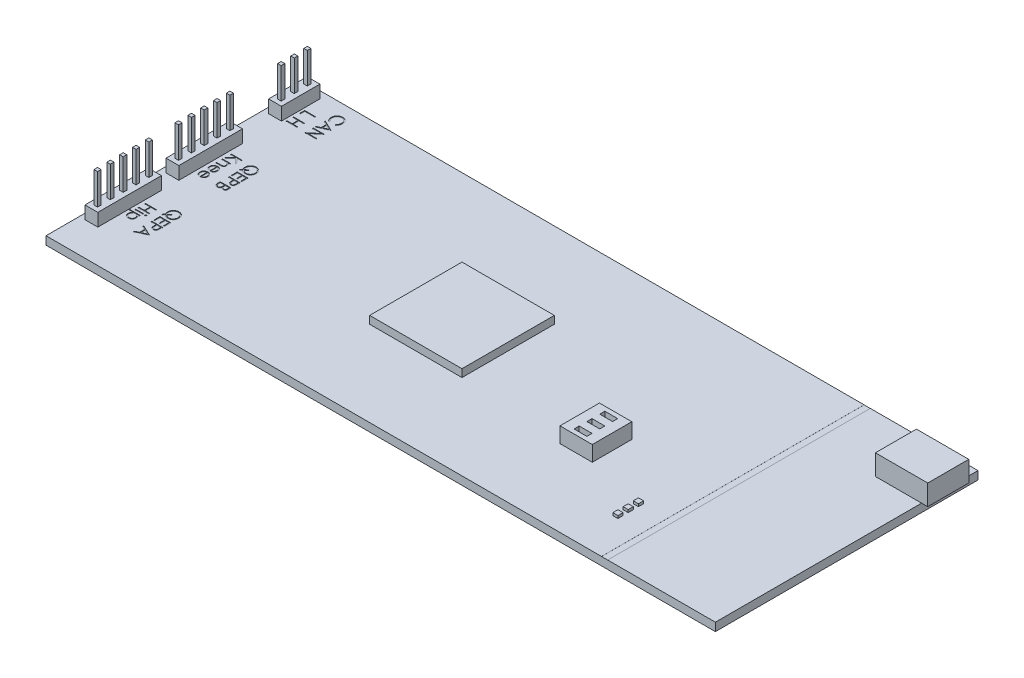
from build123d import *

# Parameters (mm, degrees)
SKIZZE1_W                            = 130.5
SKIZZE1_H                            = 51.2
AUFSATZ_LINEAR_AUSTRAGEN1_DEPTH      = 1.6
AUFSATZ_LINEAR_AUSTRAGEN2_DEPTH      = 1.2
AUFSATZ_LINEAR_AUSTRAGEN2_DEPTH_BACK = 9
SKIZZE2_W                            = 8
SKIZZE2_H                            = 4
SKIZZE4_W                            = 2.5
SKIZZE4_H                            = 7.5
SKIZZE4_H_2                          = 12.4
AUFSATZ_LINEAR_AUSTRAGEN3_DEPTH      = 2.5
SKIZZE5_W                            = 0.7
SKIZZE5_H                            = 0.7
AUFSATZ_LINEAR_AUSTRAGEN4_DEPTH      = 6
SKIZZE6_W                            = 1.2
SKIZZE6_H                            = 51.2
SCHNITT_LINEAR_AUSTRAGEN1_DEPTH      = 0.01
SKIZZE7_W                            = 18
SKIZZE7_H                            = 18
AUFSATZ_LINEAR_AUSTRAGEN5_DEPTH      = 1.5
SKIZZE8_W                            = 6.3
SKIZZE8_H                            = 7.7
AUFSATZ_LINEAR_AUSTRAGEN6_DEPTH      = 3
SKIZZE9_W                            = 2.5
SKIZZE9_H                            = 1
SCHNITT_LINEAR_AUSTRAGEN2_DEPTH      = 1
SKIZZE10_W                           = 1
SKIZZE10_H                           = 1
AUFSATZ_LINEAR_AUSTRAGEN7_DEPTH      = 0.5
SKIZZE11_W                           = 1.546794871
SKIZZE11_H                           = 0.189957265
SCHNITT_LINEAR_AUSTRAGEN3_DEPTH      = 0.1


with BuildPart() as part:
    # Skizze1 → Aufsatz-Linear austragen1 (new body)
    with BuildSketch(Plane(origin=(0, 0, 0), x_dir=(1, 0, 0), z_dir=(0, 1, 0))):
        Rectangle(SKIZZE1_W, SKIZZE1_H)
    extrude(amount=AUFSATZ_LINEAR_AUSTRAGEN1_DEPTH)

    # Skizze2 → Aufsatz-Linear austragen2 (add, two sides: drawn at the far end of the back side and taken through both)
    with BuildSketch(Plane(origin=(65.25, 0, 0), x_dir=(0, 0, -1), z_dir=(1, 0, 0)).offset(-AUFSATZ_LINEAR_AUSTRAGEN2_DEPTH_BACK)):
        with Locations((18.6, 3.6)):
            Rectangle(SKIZZE2_W, SKIZZE2_H)
    extrude(amount=AUFSATZ_LINEAR_AUSTRAGEN2_DEPTH + AUFSATZ_LINEAR_AUSTRAGEN2_DEPTH_BACK)

    # Skizze4 → Aufsatz-Linear austragen3 (add)
    with BuildSketch(Plane(origin=(0, 1.6, 0), x_dir=(1, 0, 0), z_dir=(0, 1, 0))):
        with Locations((-62.9, 20.45)):
            Rectangle(SKIZZE4_W, SKIZZE4_H)
        with Locations((-62.9, 2.9)):
            Rectangle(SKIZZE4_W, SKIZZE4_H_2)
        with Locations((-62.9, -12.9)):
            Rectangle(SKIZZE4_W, SKIZZE4_H_2)
    extrude(amount=AUFSATZ_LINEAR_AUSTRAGEN3_DEPTH)

    # Skizze5 → Aufsatz-Linear austragen4 (add)
    with BuildSketch(Plane(origin=(0, 4.1, 0), x_dir=(1, 0, 0), z_dir=(0, 1, 0))):
        with Locations((-62.9, 23)):
            Rectangle(SKIZZE5_W, SKIZZE5_H)
        with Locations((-62.9, 20.45)):
            Rectangle(SKIZZE5_W, SKIZZE5_H)
        with Locations((-62.9, 17.9)):
            Rectangle(SKIZZE5_W, SKIZZE5_H)
        with Locations((-62.9, 7.9)):
            Rectangle(SKIZZE5_W, SKIZZE5_H)
        with Locations((-62.9, 5.4)):
            Rectangle(SKIZZE5_W, SKIZZE5_H)
        with Locations((-62.9, 2.9)):
            Rectangle(SKIZZE5_W, SKIZZE5_H)
        with Locations((-62.9, 0.4)):
            Rectangle(SKIZZE5_W, SKIZZE5_H)
        with Locations((-62.9, -2.1)):
            Rectangle(SKIZZE5_W, SKIZZE5_H)
        with Locations((-62.9, -7.9)):
            Rectangle(SKIZZE5_W, SKIZZE5_H)
        with Locations((-62.9, -10.4)):
            Rectangle(SKIZZE5_W, SKIZZE5_H)
        with Locations((-62.9, -12.9)):
            Rectangle(SKIZZE5_W, SKIZZE5_H)
        with Locations((-62.9, -15.4)):
            Rectangle(SKIZZE5_W, SKIZZE5_H)
        with Locations((-62.9, -17.9)):
            Rectangle(SKIZZE5_W, SKIZZE5_H)
    extrude(amount=AUFSATZ_LINEAR_AUSTRAGEN4_DEPTH)

    # Skizze6 → Schnitt-Linear austragen1 (cut)
    with BuildSketch(Plane(origin=(0, 1.6, 0), x_dir=(1, 0, 0), z_dir=(0, 1, 0))):
        with Locations((43.65, 0)):
            Rectangle(SKIZZE6_W, SKIZZE6_H)
    extrude(amount=-SCHNITT_LINEAR_AUSTRAGEN1_DEPTH, mode=Mode.SUBTRACT)

    # Skizze7 → Aufsatz-Linear austragen5 (add)
    with BuildSketch(Plane(origin=(0, 1.6, 0), x_dir=(1, 0, 0), z_dir=(0, 1, 0))):
        with Locations((-9.75, 0)):
            Rectangle(SKIZZE7_W, SKIZZE7_H)
    extrude(amount=AUFSATZ_LINEAR_AUSTRAGEN5_DEPTH)

    # Skizze8 → Aufsatz-Linear austragen6 (add)
    with BuildSketch(Plane(origin=(0, 1.6, 0), x_dir=(1, 0, 0), z_dir=(0, 1, 0))):
        with Locations((23.1, -6.75)):
            Rectangle(SKIZZE8_W, SKIZZE8_H)
    extrude(amount=AUFSATZ_LINEAR_AUSTRAGEN6_DEPTH)

    # Skizze9 → Schnitt-Linear austragen2 (cut)
    with BuildSketch(Plane(origin=(0, 4.6, 0), x_dir=(1, 0, 0), z_dir=(0, 1, 0))):
        with Locations((23.1, -4.25)):
            Rectangle(SKIZZE9_W, SKIZZE9_H)
        with Locations((23.1, -6.75)):
            Rectangle(SKIZZE9_W, SKIZZE9_H)
        with Locations((23.1, -9.25)):
            Rectangle(SKIZZE9_W, SKIZZE9_H)
    extrude(amount=-SCHNITT_LINEAR_AUSTRAGEN2_DEPTH, mode=Mode.SUBTRACT)

    # Skizze10 → Aufsatz-Linear austragen7 (add)
    with BuildSketch(Plane(origin=(0, 1.6, 0), x_dir=(1, 0, 0), z_dir=(0, 1, 0))):
        with Locations((37.75, -13.1)):
            Rectangle(SKIZZE10_W, SKIZZE10_H)
        with Locations((37.75, -15.1)):
            Rectangle(SKIZZE10_W, SKIZZE10_H)
        with Locations((37.75, -17.1)):
            Rectangle(SKIZZE10_W, SKIZZE10_H)
    extrude(amount=AUFSATZ_LINEAR_AUSTRAGEN7_DEPTH)

    # Skizze11 → Schnitt-Linear austragen3 (cut)
    # profile 1 of 21: a face of its own
    with BuildSketch(Plane(origin=(0, 1.6, 0), x_dir=(1, 0, 0), z_dir=(0, 1, 0))):
        with BuildLine():
            Line((-57.136991509, 4.603420186), (-57.535562556, 4.278203172))
            Line((-57.535562556, 4.278203172), (-57.535562556, 4.515225742))
            Line((-57.535562556, 4.515225742), (-57.248082588, 4.750128252))
            add(Edge.make_bspline(
                [(-57.248082588, 4.750128252), (-57.262399561, 4.773688018), (-57.290769778, 4.820373559), (-57.327337412, 4.893166716), (-57.357766454, 4.967407469), (-57.38290639, 5.042931553), (-57.403029435, 5.119628963), (-57.416995679, 5.197888623), (-57.425105703, 5.277426694), (-57.426376506, 5.330864908), (-57.427015547, 5.357737093)],
                knots=[0, 0, 0, 0, 1.030216282, 2.041455142, 3.041201647, 4.026904037, 5.014869161, 6.002481075, 6.995518502, 8, 8, 8, 8], degree=3))
            add(Edge.make_bspline(
                [(-57.427015547, 5.357737093), (-57.426086524, 5.396235802), (-57.424258481, 5.4719898), (-57.408353276, 5.583257071), (-57.38363113, 5.690144772), (-57.348341092, 5.792378283), (-57.302533508, 5.889774004), (-57.246631368, 5.982631097), (-57.180741586, 6.070982126), (-57.105501621, 6.153475526), (-57.023642131, 6.228903925), (-56.936181292, 6.295088508), (-56.844567631, 6.35136306), (-56.748345025, 6.396864445), (-56.648350969, 6.432975859), (-56.543753896, 6.457584813), (-56.435176442, 6.473513901), (-56.361248429, 6.475348971), (-56.323736968, 6.476280095)],
                knots=[0, 0, 0, 0, 1.05574053, 2.077383083, 3.077194498, 4.061905691, 5.03852134, 6.024727803, 7.030589082, 8.057245348, 9.083652609, 10.080210343, 11.061793968, 12.027891381, 12.99559829, 13.972775731, 14.971375788, 16, 16, 16, 16], degree=3))
            add(Edge.make_bspline(
                [(-56.323736968, 6.476280095), (-56.298559954, 6.475948811), (-56.248382815, 6.475288571), (-56.174065335, 6.467650941), (-56.100971313, 6.456303315), (-56.029404499, 6.440252539), (-55.959071546, 6.419240737), (-55.890111161, 6.394049742), (-55.82270096, 6.36352755), (-55.756979199, 6.329022764), (-55.693514411, 6.290540728), (-55.633213858, 6.248618825), (-55.576657179, 6.203165576), (-55.523924126, 6.154170335), (-55.474623452, 6.101908248), (-55.428854418, 6.04639177), (-55.386585229, 5.987499823), (-55.348288267, 5.925537734), (-55.314015343, 5.861035439), (-55.283702008, 5.795067303), (-55.258781691, 5.727186646), (-55.237828094, 5.658015246), (-55.221729979, 5.587158227), (-55.21047061, 5.514755287), (-55.202757949, 5.440868817), (-55.20212251, 5.39097127), (-55.201801872, 5.365793317)],
                knots=[0, 0, 0, 0, 1.030754547, 2.054267169, 3.056358621, 4.059035041, 5.05535882, 6.060771698, 7.063448118, 8.083599711, 9.099159154, 10.101167011, 11.089250986, 12.068187652, 13.04685046, 14.029613114, 15.012716649, 16.013469748, 17.010449097, 18.0025771, 18.984265202, 19.969496577, 20.960881312, 21.957255534, 22.969245453, 24, 24, 24, 24], degree=3))
            add(Edge.make_bspline(
                [(-55.201801872, 5.365793317), (-55.202724698, 5.327293934), (-55.204537186, 5.251678685), (-55.220466852, 5.140694613), (-55.245176574, 5.034223959), (-55.280559006, 4.932308164), (-55.326314595, 4.835055251), (-55.381917848, 4.742251191), (-55.448384539, 4.654618737), (-55.523176086, 4.572185509), (-55.605277537, 4.496896718), (-55.693466818, 4.431520446), (-55.785821421, 4.375408063), (-55.88306469, 4.329854595), (-55.984954175, 4.294436518), (-56.091566108, 4.269686164), (-56.202700906, 4.253829528), (-56.278454352, 4.25199748), (-56.31695278, 4.25106642)],
                knots=[0, 0, 0, 0, 1.050621994, 2.063488829, 3.054696817, 4.03098776, 5.002868493, 5.984293541, 6.979100426, 8.000779165, 9.019604587, 10.015189519, 10.993309009, 11.965189742, 12.941480684, 13.932688673, 14.949378006, 16, 16, 16, 16], degree=3))
            add(Edge.make_bspline(
                [(-56.31695278, 4.25106642), (-56.357014017, 4.252070648), (-56.435792172, 4.254045405), (-56.551219802, 4.271259726), (-56.661704149, 4.297930056), (-56.766699927, 4.336963839), (-56.866699604, 4.387010485), (-56.961997879, 4.448181441), (-57.053450934, 4.519800296), (-57.108851387, 4.575253347), (-57.136991509, 4.603420186)],
                knots=[0, 0, 0, 0, 1.045518584, 2.0559531, 3.040547655, 4.008540931, 4.974054662, 5.954823866, 6.961172636, 8, 8, 8, 8], degree=3))
        make_face()
        with BuildLine():
            add(Edge.make_bspline(
                [(-56.980531172, 4.731047724), (-56.957076708, 4.707952664), (-56.910940736, 4.662523658), (-56.835280183, 4.603580417), (-56.756632571, 4.552883316), (-56.673951701, 4.512294767), (-56.588273441, 4.480001043), (-56.498918911, 4.457689626), (-56.406294895, 4.443719577), (-56.34329119, 4.441928923), (-56.311440628, 4.441023685)],
                knots=[0, 0, 0, 0, 1.052210109, 2.069743939, 3.061837814, 4.040478349, 5.010453814, 5.985306305, 6.981502329, 8, 8, 8, 8], degree=3))
            add(Edge.make_bspline(
                [(-56.311440628, 4.441023685), (-56.290929261, 4.44126021), (-56.250381904, 4.441727779), (-56.19037893, 4.448156836), (-56.131701199, 4.45725204), (-56.074453553, 4.470419107), (-56.018751978, 4.487375054), (-55.964672089, 4.508317138), (-55.912039422, 4.532837336), (-55.861180927, 4.561422529), (-55.812170318, 4.592935285), (-55.765606971, 4.628012849), (-55.72173098, 4.666161484), (-55.67981929, 4.706964434), (-55.640735855, 4.751208378), (-55.604497427, 4.798734641), (-55.570227049, 4.848957593), (-55.539293608, 4.902125757), (-55.510855136, 4.956915534), (-55.48622918, 5.013006329), (-55.465371877, 5.069927163), (-55.448459283, 5.127589893), (-55.435146917, 5.185919901), (-55.426061891, 5.245019453), (-55.419639454, 5.304735717), (-55.419143955, 5.344858325), (-55.418895889, 5.364945293)],
                knots=[0, 0, 0, 0, 1.032958288, 2.041976502, 3.037103433, 4.023477888, 4.998866292, 5.968231228, 6.943073582, 7.921783703, 8.90545537, 9.876780072, 10.85618943, 11.833110341, 12.821898168, 13.827467856, 14.842673888, 15.88323808, 16.924703457, 17.951432745, 18.967462636, 19.976958182, 20.977218729, 21.979378626, 22.98839684, 24, 24, 24, 24], degree=3))
            add(Edge.make_bspline(
                [(-55.418895889, 5.364945293), (-55.419145712, 5.385173214), (-55.419644717, 5.425577096), (-55.426026061, 5.485581831), (-55.435158058, 5.544816377), (-55.448398869, 5.603024038), (-55.465364556, 5.660396607), (-55.486226791, 5.716688335), (-55.510470839, 5.77231423), (-55.538734565, 5.826444873), (-55.570108721, 5.878903155), (-55.603756431, 5.929101144), (-55.640915797, 5.975749369), (-55.680363868, 6.019574508), (-55.72261898, 6.060463312), (-55.76736278, 6.098634089), (-55.81512442, 6.133409773), (-55.865046694, 6.1652712), (-55.917184564, 6.193431747), (-55.970597145, 6.218829012), (-56.025873355, 6.239457227), (-56.082570752, 6.256392555), (-56.140548384, 6.270231282), (-56.20014281, 6.279150878), (-56.260982003, 6.28562816), (-56.302094416, 6.286089491), (-56.322888945, 6.28632283)],
                knots=[0, 0, 0, 0, 1.013232303, 2.023861962, 3.020621903, 4.015492728, 5.012755829, 6.016661994, 7.022041205, 8.051604144, 9.07437186, 10.084107639, 11.077439333, 12.060337995, 13.03706716, 14.02195431, 15.005108131, 15.995405045, 16.987448092, 17.972869919, 18.956865295, 19.940554735, 20.937012659, 21.9407689, 22.958447392, 24, 24, 24, 24], degree=3))
            add(Edge.make_bspline(
                [(-56.322888945, 6.28632283), (-56.353459799, 6.285524348), (-56.413602125, 6.283953486), (-56.501929273, 6.27105664), (-56.586333924, 6.249132632), (-56.667555703, 6.219540471), (-56.744922648, 6.180620084), (-56.818846862, 6.133355777), (-56.888370043, 6.076766395), (-56.954184411, 6.013300541), (-57.013800605, 5.943464836), (-57.066271727, 5.869438043), (-57.110788224, 5.791845179), (-57.146718383, 5.710444426), (-57.175571477, 5.625842308), (-57.195105607, 5.537371109), (-57.208053351, 5.445609133), (-57.209292969, 5.383081948), (-57.20992153, 5.351376917)],
                knots=[0, 0, 0, 0, 1.022497099, 2.011568113, 2.978414599, 3.935907004, 4.898116866, 5.870095606, 6.865600239, 7.892254889, 8.925238965, 9.932855416, 10.924083129, 11.912667955, 12.905586126, 13.909344924, 14.939912558, 16, 16, 16, 16], degree=3))
            add(Edge.make_bspline(
                [(-57.20992153, 5.351376917), (-57.209685429, 5.329594072), (-57.209218439, 5.286509143), (-57.202802482, 5.222980623), (-57.193879041, 5.161123984), (-57.179967661, 5.10132932), (-57.163176279, 5.043024673), (-57.142355462, 4.986630537), (-57.117813396, 4.93200063), (-57.098383476, 4.897267873), (-57.088654169, 4.879875849)],
                knots=[0, 0, 0, 0, 1.060709028, 2.098007545, 3.107816471, 4.10334608, 5.086030226, 6.061961114, 7.029549518, 8, 8, 8, 8], degree=3))
            Line((-57.088654169, 4.879875849), (-56.504365975, 5.356465058))
            Line((-56.504365975, 5.356465058), (-56.504365975, 5.119442489))
            Line((-56.504365975, 5.119442489), (-56.980531172, 4.731047724))
        make_face(mode=Mode.SUBTRACT)
    # profile 2 of 21: a face of its own
    with BuildSketch(Plane(origin=(0, 1.6, 0), x_dir=(1, 0, 0), z_dir=(0, 1, 0))):
        Polygon((-55.256075376, 3.816878386), (-55.256075376, 2.622861292), (-55.473169394, 2.622861292), (-55.473169394, 3.626921121), (-56.124451445, 3.626921121), (-56.124451445, 2.622861292), (-56.341545462, 2.622861292), (-56.341545462, 3.626921121), (-57.155648026, 3.626921121), (-57.155648026, 2.622861292), (-57.372742043, 2.622861292), (-57.372742043, 3.816878386), align=None)
    # profile 3 of 21: a face of its own
    with BuildSketch(Plane(origin=(0, 1.6, 0), x_dir=(1, 0, 0), z_dir=(0, 1, 0))):
        with BuildLine():
            Line((-55.256075376, 2.242946762), (-55.256075376, 1.827839257))
            add(Edge.make_bspline(
                [(-55.256075376, 1.827839257), (-55.256106761, 1.799287899), (-55.256166896, 1.74458223), (-55.2579901, 1.666135506), (-55.26042529, 1.594888668), (-55.263801006, 1.530995343), (-55.267790372, 1.474258941), (-55.273385653, 1.424936193), (-55.279227832, 1.382639413), (-55.285167445, 1.357295989), (-55.287876258, 1.345737895)],
                knots=[0, 0, 0, 0, 1.415646017, 2.712440637, 3.8905458, 4.950247383, 5.884950622, 6.709939814, 7.411656543, 8, 8, 8, 8], degree=3))
            add(Edge.make_bspline(
                [(-55.287876258, 1.345737895), (-55.291880925, 1.331106532), (-55.299795895, 1.302188578), (-55.315649473, 1.260520352), (-55.334444863, 1.220874028), (-55.355875007, 1.183124658), (-55.380816716, 1.147695282), (-55.408481014, 1.114132381), (-55.438852681, 1.082243447), (-55.472520492, 1.053111738), (-55.508243127, 1.02629226), (-55.546816148, 1.003285216), (-55.587400028, 0.983824294), (-55.630410395, 0.967930648), (-55.675585843, 0.955845347), (-55.723058254, 0.946916344), (-55.772664509, 0.941203457), (-55.806568104, 0.940659545), (-55.823827113, 0.940382659)],
                knots=[0, 0, 0, 0, 0.999487232, 1.975422798, 2.933948774, 3.889618007, 4.832992075, 5.786114792, 6.754729845, 7.731954186, 8.717668599, 9.695514499, 10.68728626, 11.680675814, 12.71351902, 13.766008651, 14.862761406, 16, 16, 16, 16], degree=3))
            add(Edge.make_bspline(
                [(-55.823827113, 0.940382659), (-55.841230816, 0.940637521), (-55.875282336, 0.941136175), (-55.925098261, 0.947121071), (-55.972704144, 0.955182663), (-56.017994431, 0.9675785), (-56.060700159, 0.98381374), (-56.101473951, 1.002858934), (-56.139622134, 1.025829926), (-56.1752832, 1.052224657), (-56.208490623, 1.081586811), (-56.239003761, 1.11379216), (-56.266644004, 1.148710684), (-56.291473316, 1.186231412), (-56.312915924, 1.22672013), (-56.332121532, 1.269562766), (-56.348251173, 1.315131706), (-56.35673602, 1.346665512), (-56.361050003, 1.362698365)],
                knots=[0, 0, 0, 0, 1.121902311, 2.195077645, 3.232258892, 4.234102512, 5.217864754, 6.176164875, 7.132989551, 8.084763148, 9.034132444, 9.988522005, 10.94243251, 11.903244335, 12.886203696, 13.894208494, 14.929344452, 16, 16, 16, 16], degree=3))
            add(Edge.make_bspline(
                [(-56.361050003, 1.362698365), (-56.363869996, 1.375959181), (-56.370050175, 1.405021031), (-56.376949575, 1.452883534), (-56.382838505, 1.508609553), (-56.387253955, 1.572123027), (-56.39103394, 1.643366946), (-56.394038454, 1.722379849), (-56.395689365, 1.809316839), (-56.395774511, 1.869957067), (-56.395818966, 1.901617302)],
                knots=[0, 0, 0, 0, 0.601384939, 1.31797006, 2.144135048, 3.087295005, 4.142315834, 5.309527816, 6.595305764, 8, 8, 8, 8], degree=3))
            Line((-56.395818966, 1.901617302), (-56.395818966, 2.052989497))
            Line((-56.395818966, 2.052989497), (-57.372742043, 2.052989497))
            Line((-57.372742043, 2.052989497), (-57.372742043, 2.242946762))
            Line((-57.372742043, 2.242946762), (-55.256075376, 2.242946762))
        make_face()
        with BuildLine():
            Line((-55.473169394, 2.052989497), (-56.178724949, 2.052989497))
            Line((-56.178724949, 2.052989497), (-56.183389078, 1.682403226))
            add(Edge.make_bspline(
                [(-56.183389078, 1.682403226), (-56.183400394, 1.664308617), (-56.183422238, 1.629377349), (-56.180979057, 1.578779745), (-56.178284065, 1.531957265), (-56.174063592, 1.488808228), (-56.168502722, 1.449662381), (-56.162449821, 1.414016908), (-56.154249344, 1.382393642), (-56.142815084, 1.345336964), (-56.12369381, 1.304184672), (-56.095223629, 1.25971258), (-56.059929685, 1.221413043), (-56.01970178, 1.188491717), (-55.974787171, 1.162977776), (-55.927108218, 1.143788039), (-55.876634919, 1.132610128), (-55.842112813, 1.131101804), (-55.824675136, 1.130339924)],
                knots=[0, 0, 0, 0, 1.160368111, 2.240066715, 3.248291599, 4.168343349, 5.019594299, 5.784185847, 6.485545725, 7.113397927, 8.269509094, 9.383373363, 10.487084095, 11.595623793, 12.704274681, 13.786671823, 14.88201193, 16, 16, 16, 16], degree=3))
            add(Edge.make_bspline(
                [(-55.824675136, 1.130339924), (-55.807659358, 1.131105872), (-55.773834096, 1.132628481), (-55.724236954, 1.143876209), (-55.677063856, 1.162940315), (-55.632702203, 1.188664603), (-55.59263893, 1.220640654), (-55.558141517, 1.258091436), (-55.530032183, 1.300252231), (-55.512014397, 1.33949111), (-55.500994944, 1.37432302), (-55.49328821, 1.404581193), (-55.487134119, 1.438744364), (-55.482151266, 1.476824951), (-55.477885575, 1.518527395), (-55.474991206, 1.564210097), (-55.47329699, 1.613699965), (-55.473212955, 1.648056834), (-55.473169394, 1.665866767)],
                knots=[0, 0, 0, 0, 1.120550889, 2.227516482, 3.330715807, 4.461473166, 5.594337325, 6.694900473, 7.802844763, 8.919519911, 9.52614448, 10.208195984, 10.975273469, 11.811520316, 12.738076669, 13.736566072, 14.826679847, 16, 16, 16, 16], degree=3))
            Line((-55.473169394, 1.665866767), (-55.473169394, 2.052989497))
        make_face(mode=Mode.SUBTRACT)
    # profile 4 of 21: a face of its own
    with BuildSketch(Plane(origin=(0, 1.6, 0), x_dir=(1, 0, 0), z_dir=(0, 1, 0))):
        with BuildLine():
            Line((-55.256075376, 0.506194625), (-55.256075376, 0.093207179))
            add(Edge.make_bspline(
                [(-55.256075376, 0.093207179), (-55.256181664, 0.072990909), (-55.256387675, 0.033806746), (-55.259582711, -0.023173583), (-55.263939216, -0.076543102), (-55.270851701, -0.126317288), (-55.279192442, -0.172473142), (-55.289293064, -0.21514976), (-55.301404397, -0.254211436), (-55.320663815, -0.300846281), (-55.349283064, -0.354017348), (-55.391573197, -0.411589709), (-55.443299972, -0.460819892), (-55.501649006, -0.503265903), (-55.565835878, -0.537012294), (-55.634330721, -0.561426107), (-55.70625006, -0.576882537), (-55.755624744, -0.578472114), (-55.780577914, -0.57927546)],
                knots=[0, 0, 0, 0, 1.001505555, 1.941167018, 2.826882275, 3.653841531, 4.429895133, 5.150066043, 5.825578002, 6.45369114, 7.647487171, 8.808567382, 9.977351308, 11.170798116, 12.373658725, 13.556498008, 14.765093433, 16, 16, 16, 16], degree=3))
            add(Edge.make_bspline(
                [(-55.780577914, -0.57927546), (-55.803957468, -0.578627101), (-55.849900496, -0.577353015), (-55.916989013, -0.564754825), (-55.98111467, -0.545997917), (-56.041486931, -0.51876843), (-56.09732988, -0.483742882), (-56.148311645, -0.441593679), (-56.193196727, -0.391409542), (-56.218185321, -0.353750013), (-56.230878395, -0.334620679)],
                knots=[0, 0, 0, 0, 1.044266239, 2.052081639, 3.041743201, 4.026043445, 5.00270663, 5.980942822, 6.97441044, 8, 8, 8, 8], degree=3))
            add(Edge.make_bspline(
                [(-56.230878395, -0.334620679), (-56.24010296, -0.358670298), (-56.25775184, -0.404683177), (-56.289124631, -0.468048505), (-56.322862647, -0.522860921), (-56.359901255, -0.569180755), (-56.40032419, -0.608198048), (-56.443322005, -0.643236387), (-56.491011541, -0.672590658), (-56.542034874, -0.697808452), (-56.596033895, -0.717654592), (-56.652761646, -0.731697038), (-56.711583808, -0.740325437), (-56.751677089, -0.741502006), (-56.77191739, -0.742095973)],
                knots=[0, 0, 0, 0, 1.272302504, 2.434229863, 3.488457646, 4.447234501, 5.35599188, 6.26022912, 7.18267843, 8.11661068, 9.06895546, 10.019249207, 11.000057067, 12, 12, 12, 12], degree=3))
            add(Edge.make_bspline(
                [(-56.77191739, -0.742095973), (-56.792580096, -0.741505028), (-56.833234548, -0.740342328), (-56.892959565, -0.73176947), (-56.950027787, -0.717239944), (-57.004844978, -0.697275582), (-57.057100853, -0.671071531), (-57.107449874, -0.639869335), (-57.154550776, -0.601892307), (-57.199523671, -0.559561535), (-57.239935901, -0.511617381), (-57.275914007, -0.459896897), (-57.305638048, -0.403656172), (-57.330294866, -0.343767351), (-57.349403774, -0.279832471), (-57.362670064, -0.212088586), (-57.371629721, -0.140520976), (-57.372364978, -0.091408059), (-57.372742043, -0.06622124)],
                knots=[0, 0, 0, 0, 0.978404568, 1.925038397, 2.85041836, 3.763147166, 4.682162379, 5.614488577, 6.562659439, 7.54271123, 8.535210642, 9.526693784, 10.520907202, 11.541451354, 12.589717429, 13.675358278, 14.807842563, 16, 16, 16, 16], degree=3))
            Line((-57.372742043, -0.06622124), (-57.372742043, 0.506194625))
            Line((-57.372742043, 0.506194625), (-55.256075376, 0.506194625))
        make_face()
        with BuildLine():
            Line((-55.473169394, 0.31623736), (-56.151588197, 0.31623736))
            Line((-56.151588197, 0.31623736), (-56.151588197, 0.188609823))
            add(Edge.make_bspline(
                [(-56.151588197, 0.188609823), (-56.151348351, 0.169953479), (-56.150884921, 0.13390562), (-56.149515572, 0.081563906), (-56.14584924, 0.033099908), (-56.14197149, -0.011653371), (-56.136000548, -0.052395976), (-56.128693793, -0.089264301), (-56.121033787, -0.122589541), (-56.107970202, -0.161003393), (-56.088859345, -0.204564192), (-56.058503454, -0.250706506), (-56.023329542, -0.292045165), (-55.981994934, -0.326562425), (-55.936866699, -0.355045198), (-55.887940814, -0.374053365), (-55.83712733, -0.387535607), (-55.80215185, -0.388717913), (-55.78439402, -0.389318195)],
                knots=[0, 0, 0, 0, 1.156481963, 2.23455883, 3.244418989, 4.168404366, 5.01828131, 5.794834307, 6.498111525, 7.13526334, 8.307595709, 9.435046769, 10.546766856, 11.659452936, 12.760769924, 13.837671619, 14.902137667, 16, 16, 16, 16], degree=3))
            add(Edge.make_bspline(
                [(-55.78439402, -0.389318195), (-55.77264052, -0.389017969), (-55.749584747, -0.388429041), (-55.716104201, -0.383069103), (-55.6842128, -0.37529178), (-55.654644024, -0.363141229), (-55.626557444, -0.348448702), (-55.601200573, -0.32933639), (-55.57718421, -0.307752109), (-55.555390177, -0.282403473), (-55.535862638, -0.25341322), (-55.518680116, -0.220505127), (-55.505126052, -0.183286254), (-55.492967335, -0.142600497), (-55.48453051, -0.097796716), (-55.477476201, -0.049312707), (-55.4738903, 0.003262837), (-55.473415056, 0.039636197), (-55.473169394, 0.058438215)],
                knots=[0, 0, 0, 0, 0.911752476, 1.788502045, 2.626783689, 3.45400582, 4.26402138, 5.080402872, 5.911472738, 6.767166405, 7.66795952, 8.620018292, 9.640966946, 10.73819047, 11.913090943, 13.176185384, 14.540321519, 16, 16, 16, 16], degree=3))
            Line((-55.473169394, 0.058438215), (-55.473169394, 0.31623736))
        make_face(mode=Mode.SUBTRACT)
        with BuildLine():
            Line((-56.368682214, 0.31623736), (-57.155648026, 0.31623736))
            Line((-57.155648026, 0.31623736), (-57.155648026, 0.045717862))
            add(Edge.make_bspline(
                [(-57.155648026, 0.045717862), (-57.155416761, 0.02635394), (-57.154971028, -0.010967468), (-57.153500008, -0.06485122), (-57.150224267, -0.114658424), (-57.144883936, -0.16041774), (-57.139334866, -0.202531975), (-57.131654685, -0.240582723), (-57.122923248, -0.274628319), (-57.109410936, -0.314100035), (-57.088455151, -0.358576261), (-57.056652504, -0.406472678), (-57.01926345, -0.449481695), (-56.975444857, -0.48558561), (-56.928160349, -0.515398808), (-56.877657242, -0.536308543), (-56.825476234, -0.549753203), (-56.789806278, -0.551341939), (-56.77191739, -0.552138708)],
                knots=[0, 0, 0, 0, 1.159821618, 2.235403267, 3.228114831, 4.14795534, 4.994323282, 5.771256229, 6.471395042, 7.097801288, 8.267864287, 9.404187171, 10.531774336, 11.667624178, 12.792825787, 13.866573821, 14.930062559, 16, 16, 16, 16], degree=3))
            add(Edge.make_bspline(
                [(-56.77191739, -0.552138708), (-56.760731876, -0.551975851), (-56.738541269, -0.551652764), (-56.705956131, -0.54659699), (-56.674251131, -0.539543855), (-56.643905696, -0.52933031), (-56.614426039, -0.516451858), (-56.586325652, -0.500289888), (-56.558932643, -0.481625876), (-56.52434148, -0.452429193), (-56.48447302, -0.410002188), (-56.445444656, -0.349699872), (-56.413967713, -0.281137601), (-56.40060285, -0.231409407), (-56.393698907, -0.205721107)],
                knots=[0, 0, 0, 0, 0.723503378, 1.435336582, 2.130201219, 2.824764462, 3.504949994, 4.209866579, 4.920640069, 5.648298893, 7.13757748, 8.670694625, 10.280166878, 12, 12, 12, 12], degree=3))
            add(Edge.make_bspline(
                [(-56.393698907, -0.205721107), (-56.391609264, -0.195422568), (-56.387078486, -0.173093211), (-56.382298909, -0.136681775), (-56.378011473, -0.094973552), (-56.374923321, -0.04814681), (-56.371608244, 0.003984687), (-56.370364888, 0.061404191), (-56.368847306, 0.124152295), (-56.368738652, 0.167690593), (-56.368682214, 0.19030587)],
                knots=[0, 0, 0, 0, 0.634452549, 1.375623993, 2.216454381, 3.166361212, 4.209414599, 5.370755378, 6.634280627, 8, 8, 8, 8], degree=3))
            Line((-56.368682214, 0.19030587), (-56.368682214, 0.31623736))
        make_face(mode=Mode.SUBTRACT)
    # profile 5 of 21: a face of its own
    with BuildSketch(Plane(origin=(0, 1.6, 0), x_dir=(1, 0, 0), z_dir=(0, 1, 0))):
        Polygon((-58.865263411, 6.259186078), (-58.865263411, 6.069228813), (-59.671309751, 6.069228813), (-58.865263411, 5.186860357), (-58.865263411, 4.915916847), (-59.815049735, 5.956017675), (-60.981930077, 4.834506591), (-60.981930077, 5.087641607), (-59.960485766, 6.069228813), (-60.981930077, 6.069228813), (-60.981930077, 6.259186078), align=None)
    # profile 6 of 21: a face of its own
    with BuildSketch(Plane(origin=(0, 1.6, 0), x_dir=(1, 0, 0), z_dir=(0, 1, 0))):
        with BuildLine():
            Line((-59.435135206, 4.576707446), (-59.435135206, 4.386750181))
            Line((-59.435135206, 4.386750181), (-59.714134938, 4.386750181))
            add(Edge.make_bspline(
                [(-59.714134938, 4.386750181), (-59.688830054, 4.366467897), (-59.639725042, 4.327109417), (-59.575184504, 4.261562701), (-59.521998582, 4.192290914), (-59.479602478, 4.119718273), (-59.447642852, 4.043746263), (-59.424561551, 3.964837975), (-59.410721678, 3.882520987), (-59.408913301, 3.826541541), (-59.407998453, 3.798221869)],
                knots=[0, 0, 0, 0, 1.12780773, 2.188550248, 3.19190651, 4.159438251, 5.104880172, 6.052711206, 7.014878035, 8, 8, 8, 8], degree=3))
            add(Edge.make_bspline(
                [(-59.407998453, 3.798221869), (-59.409055451, 3.769598878), (-59.411124251, 3.71357678), (-59.427440783, 3.631996765), (-59.455472178, 3.555735894), (-59.493482114, 3.484961228), (-59.541004442, 3.421299151), (-59.596665309, 3.365895862), (-59.660198044, 3.319681233), (-59.719319479, 3.288741806), (-59.771742373, 3.268342546), (-59.816644725, 3.255502804), (-59.866669284, 3.244598119), (-59.921666153, 3.235144705), (-59.982020275, 3.228748049), (-60.047484362, 3.223702956), (-60.118037173, 3.220087267), (-60.166833371, 3.219943814), (-60.191996183, 3.219869839)],
                knots=[0, 0, 0, 0, 1.235764744, 2.418689688, 3.575570385, 4.733739044, 5.876600945, 6.994686206, 8.113221397, 9.257403329, 9.866223892, 10.540462211, 11.272173464, 12.077110251, 12.949508505, 13.892531187, 14.913238277, 16, 16, 16, 16], degree=3))
            Line((-60.191996183, 3.219869839), (-60.981930077, 3.219869839))
            Line((-60.981930077, 3.219869839), (-60.981930077, 3.409827104))
            Line((-60.981930077, 3.409827104), (-60.254325911, 3.409827104))
            add(Edge.make_bspline(
                [(-60.254325911, 3.409827104), (-60.233266623, 3.409943949), (-60.192983788, 3.410167453), (-60.135308236, 3.410872392), (-60.083004448, 3.412571656), (-60.036197469, 3.414959445), (-59.994932244, 3.418454383), (-59.959124729, 3.422096641), (-59.928820387, 3.426550698), (-59.910577694, 3.430519698), (-59.902396156, 3.432299727)],
                knots=[0, 0, 0, 0, 1.430800155, 2.736877192, 3.918605307, 4.986035426, 5.920637409, 6.731861385, 7.431261377, 8, 8, 8, 8], degree=3))
            add(Edge.make_bspline(
                [(-59.902396156, 3.432299727), (-59.878380345, 3.438725643), (-59.832157337, 3.451093545), (-59.769459038, 3.481654573), (-59.716120134, 3.520246958), (-59.672470402, 3.56735661), (-59.63850042, 3.62252848), (-59.614930457, 3.685609466), (-59.600188618, 3.755990834), (-59.598720781, 3.805493247), (-59.597955718, 3.831294786)],
                knots=[0, 0, 0, 0, 1.084156227, 2.086665306, 3.027808233, 3.945421172, 4.874247719, 5.839848303, 6.874090471, 8, 8, 8, 8], degree=3))
            add(Edge.make_bspline(
                [(-59.597955718, 3.831294786), (-59.598243481, 3.846575772), (-59.598812955, 3.876816448), (-59.604530303, 3.921658746), (-59.613873136, 3.965158667), (-59.62651527, 4.007735356), (-59.643718551, 4.048485646), (-59.663631582, 4.08860037), (-59.688015787, 4.126931516), (-59.715338623, 4.16420406), (-59.745789204, 4.198839575), (-59.777449826, 4.231528744), (-59.811653409, 4.260249709), (-59.847188776, 4.286320456), (-59.884770245, 4.308797992), (-59.923995965, 4.328426114), (-59.964928016, 4.34507819), (-59.993336681, 4.353353024), (-60.007551071, 4.35749337)],
                knots=[0, 0, 0, 0, 1.02388931, 2.02625049, 3.024079426, 4.004119353, 4.998163158, 5.985366248, 7.002659681, 8.039138713, 9.080111048, 10.09169763, 11.086418407, 12.069932368, 13.043171485, 14.017654831, 15.008125612, 16, 16, 16, 16], degree=3))
            add(Edge.make_bspline(
                [(-60.007551071, 4.35749337), (-60.01798636, 4.359875919), (-60.04070344, 4.365062605), (-60.077983636, 4.370664623), (-60.121109192, 4.375749204), (-60.170029784, 4.380004889), (-60.22491669, 4.382608641), (-60.285535506, 4.385447633), (-60.352127949, 4.386481208), (-60.39849002, 4.386658013), (-60.422658576, 4.386750181)],
                knots=[0, 0, 0, 0, 0.615963638, 1.340920617, 2.168419149, 3.115676021, 4.16674242, 5.331190069, 6.6087489, 8, 8, 8, 8], degree=3))
            Line((-60.422658576, 4.386750181), (-60.981930077, 4.386750181))
            Line((-60.981930077, 4.386750181), (-60.981930077, 4.576707446))
            Line((-60.981930077, 4.576707446), (-59.435135206, 4.576707446))
        make_face()
    # profile 7 of 21: a face of its own
    with BuildSketch(Plane(origin=(0, 1.6, 0), x_dir=(1, 0, 0), z_dir=(0, 1, 0))):
        with BuildLine():
            Line((-60.493468539, 1.516190619), (-60.582086995, 1.347433942))
            add(Edge.make_bspline(
                [(-60.582086995, 1.347433942), (-60.605938868, 1.360883722), (-60.652345167, 1.387051668), (-60.716133214, 1.432019761), (-60.773320171, 1.479215959), (-60.823020754, 1.530268036), (-60.866111718, 1.584547213), (-60.903564467, 1.642133223), (-60.935831716, 1.702833641), (-60.962872577, 1.76686244), (-60.983688693, 1.83477281), (-60.99838511, 1.90675365), (-61.007471129, 1.982936086), (-61.008526451, 2.035155012), (-61.009066829, 2.061893744)],
                knots=[0, 0, 0, 0, 1.120373846, 2.179803828, 3.190307243, 4.151866639, 5.090753574, 6.023181945, 6.960194942, 7.901556876, 8.864247182, 9.862852693, 10.905672442, 12, 12, 12, 12], degree=3))
            add(Edge.make_bspline(
                [(-61.009066829, 2.061893744), (-61.008373061, 2.09161294), (-61.007019721, 2.149586481), (-60.995352374, 2.233974806), (-60.976319088, 2.313428067), (-60.949730413, 2.387941835), (-60.915000521, 2.457333493), (-60.872691819, 2.521741469), (-60.823020878, 2.581502557), (-60.765560383, 2.634740787), (-60.704060217, 2.682647618), (-60.640006682, 2.724996997), (-60.573367201, 2.760155067), (-60.505178146, 2.789721355), (-60.434811977, 2.812122664), (-60.362654353, 2.828520463), (-60.288347722, 2.837792728), (-60.238096382, 2.839230673), (-60.212772759, 2.839955309)],
                knots=[0, 0, 0, 0, 1.145226127, 2.234004399, 3.276654467, 4.290038057, 5.276870678, 6.260645262, 7.254731018, 8.264593254, 9.273837991, 10.257612574, 11.220387342, 12.174754112, 13.118989047, 14.062768009, 15.023752772, 16, 16, 16, 16], degree=3))
            add(Edge.make_bspline(
                [(-60.212772759, 2.839955309), (-60.189008742, 2.839314781), (-60.1419116, 2.838045338), (-60.07220339, 2.830043862), (-60.004452849, 2.815863228), (-59.938603683, 2.796404213), (-59.874766145, 2.771275602), (-59.812901383, 2.740534212), (-59.753075227, 2.704132155), (-59.715336189, 2.676027252), (-59.696326445, 2.661870373)],
                knots=[0, 0, 0, 0, 1.024358464, 2.0301432, 3.019427413, 4.004406732, 4.986367066, 5.972626655, 6.978780325, 8, 8, 8, 8], degree=3))
            add(Edge.make_bspline(
                [(-59.696326445, 2.661870373), (-59.673424795, 2.642694775), (-59.628346961, 2.604951012), (-59.569117593, 2.541114549), (-59.519500643, 2.471990145), (-59.478372518, 2.398444066), (-59.447122264, 2.319621532), (-59.423834346, 2.236582103), (-59.410784787, 2.148380249), (-59.408941573, 2.088082329), (-59.407998453, 2.057229615)],
                knots=[0, 0, 0, 0, 1.030682036, 2.02871468, 2.997146059, 3.962720338, 4.930598197, 5.918074684, 6.934738563, 8, 8, 8, 8], degree=3))
            add(Edge.make_bspline(
                [(-59.407998453, 2.057229615), (-59.408817331, 2.025511301), (-59.410423781, 1.9632872), (-59.425316849, 1.872553488), (-59.448934347, 1.786701055), (-59.482289258, 1.705764255), (-59.525323844, 1.629734882), (-59.578628672, 1.559107128), (-59.640567229, 1.492673118), (-59.688200218, 1.454023644), (-59.712438891, 1.434356351)],
                knots=[0, 0, 0, 0, 1.056321875, 2.072262726, 3.055038591, 4.01806755, 4.982017516, 5.957941055, 6.960871419, 8, 8, 8, 8], degree=3))
            add(Edge.make_bspline(
                [(-59.712438891, 1.434356351), (-59.730704867, 1.420974821), (-59.767115234, 1.394300834), (-59.82648541, 1.360889493), (-59.888600865, 1.331886687), (-59.954465663, 1.308704373), (-60.023299409, 1.289932865), (-60.095594186, 1.276351836), (-60.171328466, 1.268387353), (-60.222930716, 1.266821807), (-60.24923777, 1.266023685)],
                knots=[0, 0, 0, 0, 0.94817472, 1.890038105, 2.849395472, 3.817997239, 4.812318967, 5.836947057, 6.897266129, 8, 8, 8, 8], degree=3))
            Line((-60.24923777, 1.266023685), (-60.24923777, 2.649998044))
            add(Edge.make_bspline(
                [(-60.24923777, 2.649998044), (-60.269618114, 2.649066065), (-60.30969524, 2.647233364), (-60.368345335, 2.638709631), (-60.424187982, 2.625208879), (-60.476985249, 2.606442442), (-60.526910488, 2.582911266), (-60.574307777, 2.554992195), (-60.618457299, 2.521480457), (-60.659931175, 2.484163869), (-60.696851553, 2.442606746), (-60.72992262, 2.398902656), (-60.757487449, 2.352477972), (-60.780198747, 2.303800698), (-60.797678884, 2.252618388), (-60.8097163, 2.199003018), (-60.8177579, 2.143121376), (-60.818653578, 2.105030388), (-60.819109565, 2.085638402)],
                knots=[0, 0, 0, 0, 1.094405546, 2.152104367, 3.174987145, 4.173015398, 5.153654967, 6.133208507, 7.119289451, 8.123438607, 9.122504012, 10.097966803, 11.060604936, 12.014205423, 12.976096155, 13.956823727, 14.959826266, 16, 16, 16, 16], degree=3))
            add(Edge.make_bspline(
                [(-60.819109565, 2.085638402), (-60.818744392, 2.066677939), (-60.818019821, 2.029056744), (-60.810869623, 1.972900656), (-60.799497317, 1.917622922), (-60.783866575, 1.863620572), (-60.76461142, 1.812067758), (-60.74153068, 1.764188025), (-60.716290928, 1.719820072), (-60.686969631, 1.678591782), (-60.651451608, 1.638601907), (-60.606620545, 1.599431566), (-60.554143588, 1.5568639), (-60.514486443, 1.530279888), (-60.493468539, 1.516190619)],
                knots=[0, 0, 0, 0, 0.990963276, 1.966261236, 2.95471375, 3.93937425, 4.902926125, 5.828461241, 6.715766441, 7.568835615, 8.469155523, 9.505141836, 10.677749234, 12, 12, 12, 12], degree=3))
        make_face()
        with BuildLine():
            add(Edge.make_bspline(
                [(-60.059280505, 1.45598095), (-60.034078297, 1.462921814), (-59.985572159, 1.476280742), (-59.918561355, 1.504374204), (-59.858660885, 1.535293892), (-59.806859791, 1.572614312), (-59.761173886, 1.615264286), (-59.720845437, 1.664007163), (-59.684940044, 1.718728215), (-59.654601754, 1.779050532), (-59.628786757, 1.842940929), (-59.611474788, 1.909830733), (-59.599615838, 1.978082984), (-59.598511457, 2.024247031), (-59.597955718, 2.047477344)],
                knots=[0, 0, 0, 0, 1.154756201, 2.222533969, 3.206705588, 4.129403772, 5.035894089, 5.963342549, 6.920206228, 7.923656548, 8.944970878, 9.96070521, 10.973801891, 12, 12, 12, 12], degree=3))
            add(Edge.make_bspline(
                [(-59.597955718, 2.047477344), (-59.598327195, 2.066435766), (-59.599061527, 2.103912579), (-59.605975666, 2.15913557), (-59.617553277, 2.212265143), (-59.632971645, 2.263593833), (-59.654215033, 2.312228207), (-59.6786186, 2.359433902), (-59.708600767, 2.404044881), (-59.731432984, 2.431950548), (-59.742967738, 2.446048391)],
                knots=[0, 0, 0, 0, 1.048700258, 2.073059931, 3.073189922, 4.055269162, 5.032885305, 6.005420607, 6.992345662, 8, 8, 8, 8], degree=3))
            add(Edge.make_bspline(
                [(-59.742967738, 2.446048391), (-59.752096205, 2.456143852), (-59.770569997, 2.476574605), (-59.802398136, 2.503873873), (-59.836719319, 2.530011968), (-59.874846609, 2.553799463), (-59.916345842, 2.575617813), (-59.960866983, 2.596034561), (-60.008747876, 2.614411105), (-60.042114066, 2.624750181), (-60.059280505, 2.630069492)],
                knots=[0, 0, 0, 0, 0.879870761, 1.780643979, 2.707998968, 3.669668524, 4.684282772, 5.740141944, 6.837334558, 8, 8, 8, 8], degree=3))
            Line((-60.059280505, 2.630069492), (-60.059280505, 1.45598095))
        make_face(mode=Mode.SUBTRACT)
    # profile 8 of 21: a face of its own
    with BuildSketch(Plane(origin=(0, 1.6, 0), x_dir=(1, 0, 0), z_dir=(0, 1, 0))):
        with BuildLine():
            Line((-60.493468539, -0.383382031), (-60.582086995, -0.552138708))
            add(Edge.make_bspline(
                [(-60.582086995, -0.552138708), (-60.605938868, -0.538688928), (-60.652345167, -0.512520982), (-60.716133214, -0.467552888), (-60.773320171, -0.420356691), (-60.823020754, -0.369304614), (-60.866111718, -0.315025437), (-60.903564467, -0.257439426), (-60.935831716, -0.196739009), (-60.962872577, -0.132710209), (-60.983688693, -0.06479984), (-60.99838511, 0.007181), (-61.007471129, 0.083363436), (-61.008526451, 0.135582362), (-61.009066829, 0.162321094)],
                knots=[0, 0, 0, 0, 1.120373846, 2.179803828, 3.190307243, 4.151866639, 5.090753574, 6.023181945, 6.960194942, 7.901556876, 8.864247182, 9.862852693, 10.905672442, 12, 12, 12, 12], degree=3))
            add(Edge.make_bspline(
                [(-61.009066829, 0.162321094), (-61.008373061, 0.19204029), (-61.007019721, 0.250013831), (-60.995352374, 0.334402157), (-60.976319088, 0.413855417), (-60.949730413, 0.488369185), (-60.915000521, 0.557760843), (-60.872691819, 0.622168819), (-60.823020878, 0.681929907), (-60.765560383, 0.735168138), (-60.704060217, 0.783074968), (-60.640006682, 0.825424347), (-60.573367201, 0.860582418), (-60.505178146, 0.890148705), (-60.434811977, 0.912550015), (-60.362654353, 0.928947814), (-60.288347722, 0.938220079), (-60.238096382, 0.939658023), (-60.212772759, 0.940382659)],
                knots=[0, 0, 0, 0, 1.145226127, 2.234004399, 3.276654467, 4.290038057, 5.276870678, 6.260645262, 7.254731018, 8.264593254, 9.273837991, 10.257612574, 11.220387342, 12.174754112, 13.118989047, 14.062768009, 15.023752772, 16, 16, 16, 16], degree=3))
            add(Edge.make_bspline(
                [(-60.212772759, 0.940382659), (-60.189008742, 0.939742131), (-60.1419116, 0.938472689), (-60.07220339, 0.930471212), (-60.004452849, 0.916290578), (-59.938603683, 0.896831563), (-59.874766145, 0.871702952), (-59.812901383, 0.840961563), (-59.753075227, 0.804559506), (-59.715336189, 0.776454603), (-59.696326445, 0.762297724)],
                knots=[0, 0, 0, 0, 1.024358464, 2.0301432, 3.019427413, 4.004406732, 4.986367066, 5.972626655, 6.978780325, 8, 8, 8, 8], degree=3))
            add(Edge.make_bspline(
                [(-59.696326445, 0.762297724), (-59.673424795, 0.743122125), (-59.628346961, 0.705378362), (-59.569117593, 0.641541899), (-59.519500643, 0.572417495), (-59.478372518, 0.498871416), (-59.447122264, 0.420048882), (-59.423834346, 0.337009454), (-59.410784787, 0.248807599), (-59.408941573, 0.18850968), (-59.407998453, 0.157656965)],
                knots=[0, 0, 0, 0, 1.030682036, 2.02871468, 2.997146059, 3.962720338, 4.930598197, 5.918074684, 6.934738563, 8, 8, 8, 8], degree=3))
            add(Edge.make_bspline(
                [(-59.407998453, 0.157656965), (-59.408817331, 0.125938651), (-59.410423781, 0.06371455), (-59.425316849, -0.027019161), (-59.448934347, -0.112871594), (-59.482289258, -0.193808395), (-59.525323844, -0.269837768), (-59.578628672, -0.340465521), (-59.640567229, -0.406899531), (-59.688200218, -0.445549005), (-59.712438891, -0.465216299)],
                knots=[0, 0, 0, 0, 1.056321875, 2.072262726, 3.055038591, 4.01806755, 4.982017516, 5.957941055, 6.960871419, 8, 8, 8, 8], degree=3))
            add(Edge.make_bspline(
                [(-59.712438891, -0.465216299), (-59.730704867, -0.478597828), (-59.767115234, -0.505271815), (-59.82648541, -0.538683157), (-59.888600865, -0.567685962), (-59.954465663, -0.590868277), (-60.023299409, -0.609639785), (-60.095594186, -0.623220813), (-60.171328466, -0.631185297), (-60.222930716, -0.632750842), (-60.24923777, -0.633548964)],
                knots=[0, 0, 0, 0, 0.94817472, 1.890038105, 2.849395472, 3.817997239, 4.812318967, 5.836947057, 6.897266129, 8, 8, 8, 8], degree=3))
            Line((-60.24923777, -0.633548964), (-60.24923777, 0.750425395))
            add(Edge.make_bspline(
                [(-60.24923777, 0.750425395), (-60.269618114, 0.749493415), (-60.30969524, 0.747660715), (-60.368345335, 0.739136982), (-60.424187982, 0.72563623), (-60.476985249, 0.706869793), (-60.526910488, 0.683338617), (-60.574307777, 0.655419546), (-60.618457299, 0.621907808), (-60.659931175, 0.58459122), (-60.696851553, 0.543034097), (-60.72992262, 0.499330006), (-60.757487449, 0.452905323), (-60.780198747, 0.404228048), (-60.797678884, 0.353045738), (-60.8097163, 0.299430369), (-60.8177579, 0.243548727), (-60.818653578, 0.205457738), (-60.819109565, 0.186065752)],
                knots=[0, 0, 0, 0, 1.094405546, 2.152104367, 3.174987145, 4.173015398, 5.153654967, 6.133208507, 7.119289451, 8.123438607, 9.122504012, 10.097966803, 11.060604936, 12.014205423, 12.976096155, 13.956823727, 14.959826266, 16, 16, 16, 16], degree=3))
            add(Edge.make_bspline(
                [(-60.819109565, 0.186065752), (-60.818744392, 0.16710529), (-60.818019821, 0.129484095), (-60.810869623, 0.073328006), (-60.799497317, 0.018050272), (-60.783866575, -0.035952077), (-60.76461142, -0.087504891), (-60.74153068, -0.135384624), (-60.716290928, -0.179752578), (-60.686969631, -0.220980867), (-60.651451608, -0.260970743), (-60.606620545, -0.300141084), (-60.554143588, -0.34270875), (-60.514486443, -0.369292761), (-60.493468539, -0.383382031)],
                knots=[0, 0, 0, 0, 0.990963276, 1.966261236, 2.95471375, 3.93937425, 4.902926125, 5.828461241, 6.715766441, 7.568835615, 8.469155523, 9.505141836, 10.677749234, 12, 12, 12, 12], degree=3))
        make_face()
        with BuildLine():
            add(Edge.make_bspline(
                [(-60.059280505, -0.4435917), (-60.034078297, -0.436650836), (-59.985572159, -0.423291908), (-59.918561355, -0.395198446), (-59.858660885, -0.364278757), (-59.806859791, -0.326958338), (-59.761173886, -0.284308363), (-59.720845437, -0.235565486), (-59.684940044, -0.180844434), (-59.654601754, -0.120522117), (-59.628786757, -0.05663172), (-59.611474788, 0.010258084), (-59.599615838, 0.078510334), (-59.598511457, 0.124674381), (-59.597955718, 0.147904695)],
                knots=[0, 0, 0, 0, 1.154756201, 2.222533969, 3.206705588, 4.129403772, 5.035894089, 5.963342549, 6.920206228, 7.923656548, 8.944970878, 9.96070521, 10.973801891, 12, 12, 12, 12], degree=3))
            add(Edge.make_bspline(
                [(-59.597955718, 0.147904695), (-59.598327195, 0.166863116), (-59.599061527, 0.204339929), (-59.605975666, 0.259562921), (-59.617553277, 0.312692494), (-59.632971645, 0.364021183), (-59.654215033, 0.412655558), (-59.6786186, 0.459861252), (-59.708600767, 0.504472231), (-59.731432984, 0.532377899), (-59.742967738, 0.546475742)],
                knots=[0, 0, 0, 0, 1.048700258, 2.073059931, 3.073189922, 4.055269162, 5.032885305, 6.005420607, 6.992345662, 8, 8, 8, 8], degree=3))
            add(Edge.make_bspline(
                [(-59.742967738, 0.546475742), (-59.752096205, 0.556571203), (-59.770569997, 0.577001955), (-59.802398136, 0.604301223), (-59.836719319, 0.630439318), (-59.874846609, 0.654226813), (-59.916345842, 0.676045163), (-59.960866983, 0.696461911), (-60.008747876, 0.714838456), (-60.042114066, 0.725177532), (-60.059280505, 0.730496842)],
                knots=[0, 0, 0, 0, 0.879870761, 1.780643979, 2.707998968, 3.669668524, 4.684282772, 5.740141944, 6.837334558, 8, 8, 8, 8], degree=3))
            Line((-60.059280505, 0.730496842), (-60.059280505, -0.4435917))
        make_face(mode=Mode.SUBTRACT)
    # profile 9 of 21: a face of its own
    with BuildSketch(Plane(origin=(0, 1.6, 0), x_dir=(1, 0, 0), z_dir=(0, 1, 0))):
        with BuildLine():
            Line((-57.136991509, -10.471041971), (-57.535562556, -10.796258985))
            Line((-57.535562556, -10.796258985), (-57.535562556, -10.559236415))
            Line((-57.535562556, -10.559236415), (-57.248082588, -10.324333905))
            add(Edge.make_bspline(
                [(-57.248082588, -10.324333905), (-57.262399561, -10.300774139), (-57.290769778, -10.254088598), (-57.327337412, -10.181295441), (-57.357766454, -10.107054688), (-57.38290639, -10.031530604), (-57.403029435, -9.954833194), (-57.416995679, -9.876573534), (-57.425105703, -9.797035463), (-57.426376506, -9.743597249), (-57.427015547, -9.716725064)],
                knots=[0, 0, 0, 0, 1.030216282, 2.041455142, 3.041201647, 4.026904037, 5.014869161, 6.002481075, 6.995518502, 8, 8, 8, 8], degree=3))
            add(Edge.make_bspline(
                [(-57.427015547, -9.716725064), (-57.426086524, -9.678226355), (-57.424258481, -9.602472357), (-57.408353276, -9.491205086), (-57.38363113, -9.384317385), (-57.348341092, -9.282083874), (-57.302533508, -9.184688153), (-57.246631368, -9.09183106), (-57.180741586, -9.003480031), (-57.105501621, -8.920986632), (-57.023642131, -8.845558232), (-56.936181292, -8.779373649), (-56.844567631, -8.723099097), (-56.748345025, -8.677597713), (-56.648350969, -8.641486298), (-56.543753896, -8.616877344), (-56.435176442, -8.600948256), (-56.361248429, -8.599113186), (-56.323736968, -8.598182062)],
                knots=[0, 0, 0, 0, 1.05574053, 2.077383083, 3.077194498, 4.061905691, 5.03852134, 6.024727803, 7.030589082, 8.057245348, 9.083652609, 10.080210343, 11.061793968, 12.027891381, 12.99559829, 13.972775731, 14.971375788, 16, 16, 16, 16], degree=3))
            add(Edge.make_bspline(
                [(-56.323736968, -8.598182062), (-56.298559954, -8.598513346), (-56.248382815, -8.599173586), (-56.174065335, -8.606811216), (-56.100971313, -8.618158842), (-56.029404499, -8.634209618), (-55.959071546, -8.65522142), (-55.890111161, -8.680412415), (-55.82270096, -8.710934607), (-55.756979199, -8.745439393), (-55.693514411, -8.783921429), (-55.633213858, -8.825843332), (-55.576657179, -8.871296581), (-55.523924126, -8.920291822), (-55.474623452, -8.972553909), (-55.428854418, -9.028070387), (-55.386585229, -9.086962334), (-55.348288267, -9.148924423), (-55.314015343, -9.213426718), (-55.283702008, -9.279394854), (-55.258781691, -9.347275511), (-55.237828094, -9.416446911), (-55.221729979, -9.48730393), (-55.21047061, -9.55970687), (-55.202757949, -9.63359334), (-55.20212251, -9.683490887), (-55.201801872, -9.708668841)],
                knots=[0, 0, 0, 0, 1.030754547, 2.054267169, 3.056358621, 4.059035041, 5.05535882, 6.060771698, 7.063448118, 8.083599711, 9.099159154, 10.101167011, 11.089250986, 12.068187652, 13.04685046, 14.029613114, 15.012716649, 16.013469748, 17.010449097, 18.0025771, 18.984265202, 19.969496577, 20.960881312, 21.957255534, 22.969245453, 24, 24, 24, 24], degree=3))
            add(Edge.make_bspline(
                [(-55.201801872, -9.708668841), (-55.202724698, -9.747168223), (-55.204537186, -9.822783473), (-55.220466852, -9.933767544), (-55.245176574, -10.040238198), (-55.280559006, -10.142153993), (-55.326314595, -10.239406906), (-55.381917848, -10.332210966), (-55.448384539, -10.41984342), (-55.523176086, -10.502276648), (-55.605277537, -10.577565439), (-55.693466818, -10.642941711), (-55.785821421, -10.699054094), (-55.88306469, -10.744607562), (-55.984954175, -10.780025639), (-56.091566108, -10.804775993), (-56.202700906, -10.820632629), (-56.278454352, -10.822464677), (-56.31695278, -10.823395737)],
                knots=[0, 0, 0, 0, 1.050621994, 2.063488829, 3.054696817, 4.03098776, 5.002868493, 5.984293541, 6.979100426, 8.000779165, 9.019604587, 10.015189519, 10.993309009, 11.965189742, 12.941480684, 13.932688673, 14.949378006, 16, 16, 16, 16], degree=3))
            add(Edge.make_bspline(
                [(-56.31695278, -10.823395737), (-56.357014017, -10.822391509), (-56.435792172, -10.820416752), (-56.551219802, -10.803202431), (-56.661704149, -10.776532101), (-56.766699927, -10.737498319), (-56.866699604, -10.687451673), (-56.961997879, -10.626280717), (-57.053450934, -10.554661861), (-57.108851387, -10.49920881), (-57.136991509, -10.471041971)],
                knots=[0, 0, 0, 0, 1.045518584, 2.0559531, 3.040547655, 4.008540931, 4.974054662, 5.954823866, 6.961172636, 8, 8, 8, 8], degree=3))
        make_face()
        with BuildLine():
            add(Edge.make_bspline(
                [(-56.980531172, -10.343414434), (-56.957076708, -10.366509493), (-56.910940736, -10.411938499), (-56.835280183, -10.47088174), (-56.756632571, -10.521578841), (-56.673951701, -10.56216739), (-56.588273441, -10.594461114), (-56.498918911, -10.616772531), (-56.406294895, -10.63074258), (-56.34329119, -10.632533234), (-56.311440628, -10.633438472)],
                knots=[0, 0, 0, 0, 1.052210109, 2.069743939, 3.061837814, 4.040478349, 5.010453814, 5.985306305, 6.981502329, 8, 8, 8, 8], degree=3))
            add(Edge.make_bspline(
                [(-56.311440628, -10.633438472), (-56.290929261, -10.633201947), (-56.250381904, -10.632734378), (-56.19037893, -10.626305321), (-56.131701199, -10.617210118), (-56.074453553, -10.604043051), (-56.018751978, -10.587087103), (-55.964672089, -10.566145019), (-55.912039422, -10.541624821), (-55.861180927, -10.513039628), (-55.812170318, -10.481526872), (-55.765606971, -10.446449308), (-55.72173098, -10.408300673), (-55.67981929, -10.367497724), (-55.640735855, -10.323253779), (-55.604497427, -10.275727516), (-55.570227049, -10.225504564), (-55.539293608, -10.1723364), (-55.510855136, -10.117546623), (-55.48622918, -10.061455828), (-55.465371877, -10.004534994), (-55.448459283, -9.946872264), (-55.435146917, -9.888542256), (-55.426061891, -9.829442704), (-55.419639454, -9.76972644), (-55.419143955, -9.729603832), (-55.418895889, -9.709516864)],
                knots=[0, 0, 0, 0, 1.032958288, 2.041976502, 3.037103433, 4.023477888, 4.998866292, 5.968231228, 6.943073582, 7.921783703, 8.90545537, 9.876780072, 10.85618943, 11.833110341, 12.821898168, 13.827467856, 14.842673888, 15.88323808, 16.924703457, 17.951432745, 18.967462636, 19.976958182, 20.977218729, 21.979378626, 22.98839684, 24, 24, 24, 24], degree=3))
            add(Edge.make_bspline(
                [(-55.418895889, -9.709516864), (-55.419145712, -9.689288944), (-55.419644717, -9.648885061), (-55.426026061, -9.588880326), (-55.435158058, -9.52964578), (-55.448398869, -9.471438119), (-55.465364556, -9.41406555), (-55.486226791, -9.357773822), (-55.510470839, -9.302147927), (-55.538734565, -9.248017284), (-55.570108721, -9.195559002), (-55.603756431, -9.145361013), (-55.640915797, -9.098712788), (-55.680363868, -9.054887649), (-55.72261898, -9.013998845), (-55.76736278, -8.975828068), (-55.81512442, -8.941052384), (-55.865046694, -8.909190957), (-55.917184564, -8.881030411), (-55.970597145, -8.855633145), (-56.025873355, -8.83500493), (-56.082570752, -8.818069602), (-56.140548384, -8.804230875), (-56.20014281, -8.795311279), (-56.260982003, -8.788833997), (-56.302094416, -8.788372666), (-56.322888945, -8.788139327)],
                knots=[0, 0, 0, 0, 1.013232303, 2.023861962, 3.020621903, 4.015492728, 5.012755829, 6.016661994, 7.022041205, 8.051604144, 9.07437186, 10.084107639, 11.077439333, 12.060337995, 13.03706716, 14.02195431, 15.005108131, 15.995405045, 16.987448092, 17.972869919, 18.956865295, 19.940554735, 20.937012659, 21.9407689, 22.958447392, 24, 24, 24, 24], degree=3))
            add(Edge.make_bspline(
                [(-56.322888945, -8.788139327), (-56.353459799, -8.788937809), (-56.413602125, -8.790508671), (-56.501929273, -8.803405517), (-56.586333924, -8.825329525), (-56.667555703, -8.854921686), (-56.744922648, -8.893842073), (-56.818846862, -8.941106381), (-56.888370043, -8.997695762), (-56.954184411, -9.061161616), (-57.013800605, -9.130997322), (-57.066271727, -9.205024114), (-57.110788224, -9.282616978), (-57.146718383, -9.364017732), (-57.175571477, -9.448619849), (-57.195105607, -9.537091048), (-57.208053351, -9.628853024), (-57.209292969, -9.691380209), (-57.20992153, -9.72308524)],
                knots=[0, 0, 0, 0, 1.022497099, 2.011568113, 2.978414599, 3.935907004, 4.898116866, 5.870095606, 6.865600239, 7.892254889, 8.925238965, 9.932855416, 10.924083129, 11.912667955, 12.905586126, 13.909344924, 14.939912558, 16, 16, 16, 16], degree=3))
            add(Edge.make_bspline(
                [(-57.20992153, -9.72308524), (-57.209685429, -9.744868085), (-57.209218439, -9.787953014), (-57.202802482, -9.851481535), (-57.193879041, -9.913338173), (-57.179967661, -9.973132837), (-57.163176279, -10.031437484), (-57.142355462, -10.08783162), (-57.117813396, -10.142461527), (-57.098383476, -10.177194284), (-57.088654169, -10.194586309)],
                knots=[0, 0, 0, 0, 1.060709028, 2.098007545, 3.107816471, 4.10334608, 5.086030226, 6.061961114, 7.029549518, 8, 8, 8, 8], degree=3))
            Line((-57.088654169, -10.194586309), (-56.504365975, -9.717997099))
            Line((-56.504365975, -9.717997099), (-56.504365975, -9.955019669))
            Line((-56.504365975, -9.955019669), (-56.980531172, -10.343414434))
        make_face(mode=Mode.SUBTRACT)
    # profile 10 of 21: a face of its own
    with BuildSketch(Plane(origin=(0, 1.6, 0), x_dir=(1, 0, 0), z_dir=(0, 1, 0))):
        Polygon((-55.256075376, -11.257583771), (-55.256075376, -12.451600865), (-55.473169394, -12.451600865), (-55.473169394, -11.447541036), (-56.124451445, -11.447541036), (-56.124451445, -12.451600865), (-56.341545462, -12.451600865), (-56.341545462, -11.447541036), (-57.155648026, -11.447541036), (-57.155648026, -12.451600865), (-57.372742043, -12.451600865), (-57.372742043, -11.257583771), align=None)
    # profile 11 of 21: a face of its own
    with BuildSketch(Plane(origin=(0, 1.6, 0), x_dir=(1, 0, 0), z_dir=(0, 1, 0))):
        with BuildLine():
            Line((-55.256075376, -12.831515395), (-55.256075376, -13.2466229))
            add(Edge.make_bspline(
                [(-55.256075376, -13.2466229), (-55.256106761, -13.275174258), (-55.256166896, -13.329879927), (-55.2579901, -13.408326651), (-55.26042529, -13.479573489), (-55.263801006, -13.543466814), (-55.267790372, -13.600203217), (-55.273385653, -13.649525964), (-55.279227832, -13.691822744), (-55.285167445, -13.717166168), (-55.287876258, -13.728724263)],
                knots=[0, 0, 0, 0, 1.415646017, 2.712440637, 3.8905458, 4.950247383, 5.884950622, 6.709939814, 7.411656543, 8, 8, 8, 8], degree=3))
            add(Edge.make_bspline(
                [(-55.287876258, -13.728724263), (-55.291880925, -13.743355625), (-55.299795895, -13.772273579), (-55.315649473, -13.813941806), (-55.334444863, -13.853588129), (-55.355875007, -13.891337499), (-55.380816716, -13.926766875), (-55.408481014, -13.960329776), (-55.438852681, -13.99221871), (-55.472520492, -14.021350419), (-55.508243127, -14.048169897), (-55.546816148, -14.071176941), (-55.587400028, -14.090637863), (-55.630410395, -14.106531509), (-55.675585843, -14.118616811), (-55.723058254, -14.127545813), (-55.772664509, -14.1332587), (-55.806568104, -14.133802613), (-55.823827113, -14.134079498)],
                knots=[0, 0, 0, 0, 0.999487232, 1.975422798, 2.933948774, 3.889618007, 4.832992075, 5.786114792, 6.754729845, 7.731954186, 8.717668599, 9.695514499, 10.68728626, 11.680675814, 12.71351902, 13.766008651, 14.862761406, 16, 16, 16, 16], degree=3))
            add(Edge.make_bspline(
                [(-55.823827113, -14.134079498), (-55.841230816, -14.133824636), (-55.875282336, -14.133325982), (-55.925098261, -14.127341086), (-55.972704144, -14.119279494), (-56.017994431, -14.106883657), (-56.060700159, -14.090648417), (-56.101473951, -14.071603223), (-56.139622134, -14.048632231), (-56.1752832, -14.0222375), (-56.208490623, -13.992875346), (-56.239003761, -13.960669997), (-56.266644004, -13.925751473), (-56.291473316, -13.888230745), (-56.312915924, -13.847742027), (-56.332121532, -13.804899391), (-56.348251173, -13.759330451), (-56.35673602, -13.727796645), (-56.361050003, -13.711763793)],
                knots=[0, 0, 0, 0, 1.121902311, 2.195077645, 3.232258892, 4.234102512, 5.217864754, 6.176164875, 7.132989551, 8.084763148, 9.034132444, 9.988522005, 10.94243251, 11.903244335, 12.886203696, 13.894208494, 14.929344452, 16, 16, 16, 16], degree=3))
            add(Edge.make_bspline(
                [(-56.361050003, -13.711763793), (-56.363869996, -13.698502976), (-56.370050175, -13.669441126), (-56.376949575, -13.621578623), (-56.382838505, -13.565852604), (-56.387253955, -13.50233913), (-56.39103394, -13.431095211), (-56.394038454, -13.352082308), (-56.395689365, -13.265145318), (-56.395774511, -13.20450509), (-56.395818966, -13.172844856)],
                knots=[0, 0, 0, 0, 0.601384939, 1.31797006, 2.144135048, 3.087295005, 4.142315834, 5.309527816, 6.595305764, 8, 8, 8, 8], degree=3))
            Line((-56.395818966, -13.172844856), (-56.395818966, -13.02147266))
            Line((-56.395818966, -13.02147266), (-57.372742043, -13.02147266))
            Line((-57.372742043, -13.02147266), (-57.372742043, -12.831515395))
            Line((-57.372742043, -12.831515395), (-55.256075376, -12.831515395))
        make_face()
        with BuildLine():
            Line((-55.473169394, -13.02147266), (-56.178724949, -13.02147266))
            Line((-56.178724949, -13.02147266), (-56.183389078, -13.392058931))
            add(Edge.make_bspline(
                [(-56.183389078, -13.392058931), (-56.183400394, -13.41015354), (-56.183422238, -13.445084808), (-56.180979057, -13.495682412), (-56.178284065, -13.542504892), (-56.174063592, -13.585653929), (-56.168502722, -13.624799777), (-56.162449821, -13.660445249), (-56.154249344, -13.692068515), (-56.142815084, -13.729125193), (-56.12369381, -13.770277485), (-56.095223629, -13.814749577), (-56.059929685, -13.853049114), (-56.01970178, -13.88597044), (-55.974787171, -13.911484381), (-55.927108218, -13.930674118), (-55.876634919, -13.941852029), (-55.842112813, -13.943360354), (-55.824675136, -13.944122233)],
                knots=[0, 0, 0, 0, 1.160368111, 2.240066715, 3.248291599, 4.168343349, 5.019594299, 5.784185847, 6.485545725, 7.113397927, 8.269509094, 9.383373363, 10.487084095, 11.595623793, 12.704274681, 13.786671823, 14.88201193, 16, 16, 16, 16], degree=3))
            add(Edge.make_bspline(
                [(-55.824675136, -13.944122233), (-55.807659358, -13.943356285), (-55.773834096, -13.941833676), (-55.724236954, -13.930585948), (-55.677063856, -13.911521842), (-55.632702203, -13.885797554), (-55.59263893, -13.853821503), (-55.558141517, -13.816370721), (-55.530032183, -13.774209926), (-55.512014397, -13.734971047), (-55.500994944, -13.700139137), (-55.49328821, -13.669880964), (-55.487134119, -13.635717793), (-55.482151266, -13.597637206), (-55.477885575, -13.555934762), (-55.474991206, -13.51025206), (-55.47329699, -13.460762192), (-55.473212955, -13.426405323), (-55.473169394, -13.40859539)],
                knots=[0, 0, 0, 0, 1.120550889, 2.227516482, 3.330715807, 4.461473166, 5.594337325, 6.694900473, 7.802844763, 8.919519911, 9.52614448, 10.208195984, 10.975273469, 11.811520316, 12.738076669, 13.736566072, 14.826679847, 16, 16, 16, 16], degree=3))
            Line((-55.473169394, -13.40859539), (-55.473169394, -13.02147266))
        make_face(mode=Mode.SUBTRACT)
    # profile 12 of 21: a face of its own
    with BuildSketch(Plane(origin=(0, 1.6, 0), x_dir=(1, 0, 0), z_dir=(0, 1, 0))):
        Polygon((-55.256075376, -15.4366436), (-57.372742043, -16.413566677), (-57.372742043, -16.207072954), (-56.69432324, -15.894152281), (-56.69432324, -14.934613686), (-57.372742043, -14.612788766), (-57.372742043, -14.405447019), (-55.256075376, -15.409506848), align=None)
        Polygon((-55.668638811, -15.420955165), (-56.477229223, -15.037648541), (-56.477229223, -15.794085507), align=None, mode=Mode.SUBTRACT)
    # profile 13 of 21: a face of its own
    with BuildSketch(Plane(origin=(0, 1.6, 0), x_dir=(1, 0, 0), z_dir=(0, 1, 0))):
        Polygon((-58.865263411, -10.443481207), (-58.865263411, -10.633438472), (-59.733639479, -10.633438472), (-59.733639479, -11.718908557), (-58.865263411, -11.718908557), (-58.865263411, -11.908865822), (-60.981930077, -11.908865822), (-60.981930077, -11.718908557), (-59.950733496, -11.718908557), (-59.950733496, -10.633438472), (-60.981930077, -10.633438472), (-60.981930077, -10.443481207), align=None)
    # profile 14 of 21: a face of its own
    with BuildSketch(Plane(origin=(0, 1.6, 0), x_dir=(1, 0, 0), z_dir=(0, 1, 0))):
        with BuildLine():
            add(Edge.make_bspline(
                [(-58.783853154, -12.464321218), (-58.784402323, -12.476106855), (-58.785477701, -12.499185396), (-58.794613095, -12.532592137), (-58.810334348, -12.562980695), (-58.830740918, -12.590336852), (-58.855726728, -12.61301385), (-58.884116131, -12.629274463), (-58.915022416, -12.63965519), (-58.936557256, -12.640916126), (-58.947521691, -12.64155813)],
                knots=[0, 0, 0, 0, 1.054986045, 2.065865298, 3.074122704, 4.105114675, 5.109626121, 6.074217918, 7.019490725, 8, 8, 8, 8], degree=3))
            add(Edge.make_bspline(
                [(-58.947521691, -12.64155813), (-58.958201522, -12.640901764), (-58.979314285, -12.639604206), (-59.009684694, -12.629282137), (-59.037678781, -12.612877524), (-59.062615742, -12.590351946), (-59.083010523, -12.562976709), (-59.098734891, -12.532593192), (-59.107869462, -12.499185118), (-59.108944953, -12.476106761), (-59.10949418, -12.464321218)],
                knots=[0, 0, 0, 0, 0.961106377, 1.899993565, 2.859409042, 3.870007927, 4.90724781, 5.921615355, 6.938620636, 8, 8, 8, 8], degree=3))
            add(Edge.make_bspline(
                [(-59.10949418, -12.464321218), (-59.108962592, -12.452671034), (-59.107927927, -12.429995474), (-59.098625604, -12.397202984), (-59.083044717, -12.367303389), (-59.062333505, -12.340394607), (-59.037844595, -12.317422428), (-59.009663548, -12.301078343), (-58.979319669, -12.290728676), (-58.958203331, -12.289434837), (-58.947521691, -12.288780352)],
                knots=[0, 0, 0, 0, 1.055304112, 2.054011575, 3.063363921, 4.096942562, 5.122536081, 6.088009498, 7.032825006, 8, 8, 8, 8], degree=3))
            add(Edge.make_bspline(
                [(-58.947521691, -12.288780352), (-58.936555379, -12.289420405), (-58.915016852, -12.290677509), (-58.884137639, -12.301086376), (-58.855559499, -12.31728442), (-58.83102295, -12.34040945), (-58.81030023, -12.367299503), (-58.794722352, -12.397203996), (-58.785419242, -12.429995205), (-58.784384686, -12.452670943), (-58.783853154, -12.464321218)],
                knots=[0, 0, 0, 0, 0.986662878, 1.937868148, 2.908513651, 3.927890639, 4.955204348, 5.958438607, 6.951092507, 8, 8, 8, 8], degree=3))
        make_face()
    # profile 15 of 21: a face of its own
    with BuildSketch(Plane(origin=(0, 1.6, 0), x_dir=(1, 0, 0), z_dir=(0, 1, 0))):
        with Locations((-60.208532641, -12.465169241)):
            Rectangle(SKIZZE11_W, SKIZZE11_H)
    # profile 16 of 21: a face of its own
    with BuildSketch(Plane(origin=(0, 1.6, 0), x_dir=(1, 0, 0), z_dir=(0, 1, 0))):
        with BuildLine():
            Line((-59.435135206, -12.994335908), (-59.435135206, -13.184293173))
            Line((-59.435135206, -13.184293173), (-59.721343138, -13.184293173))
            add(Edge.make_bspline(
                [(-59.721343138, -13.184293173), (-59.695382506, -13.204471539), (-59.644933213, -13.243684155), (-59.579457153, -13.311262916), (-59.524644508, -13.382931423), (-59.481451358, -13.459771809), (-59.448719326, -13.540858322), (-59.424766562, -13.626108803), (-59.410571201, -13.716234835), (-59.408867383, -13.77785889), (-59.407998453, -13.809286495)],
                knots=[0, 0, 0, 0, 1.082960489, 2.104516986, 3.092433479, 4.050182639, 5.001196938, 5.969027827, 6.964226023, 8, 8, 8, 8], degree=3))
            add(Edge.make_bspline(
                [(-59.407998453, -13.809286495), (-59.408792614, -13.836737608), (-59.410362314, -13.890996174), (-59.420989828, -13.970862984), (-59.439203861, -14.047773811), (-59.465451081, -14.121293539), (-59.497899866, -14.192209773), (-59.538852549, -14.259472662), (-59.586269626, -14.324129908), (-59.640838594, -14.384555413), (-59.69988045, -14.440387859), (-59.763393939, -14.488675787), (-59.82929036, -14.530326891), (-59.898591292, -14.563994166), (-59.970751017, -14.590366833), (-60.046061074, -14.609123329), (-60.124242238, -14.620285808), (-60.177402454, -14.621783472), (-60.204292524, -14.622541036)],
                knots=[0, 0, 0, 0, 1.041296284, 2.058176809, 3.050446431, 4.034000596, 5.01514041, 6.003636468, 7.015969324, 8.052561599, 9.08815499, 10.094063707, 11.074456064, 12.040834395, 13.011057502, 13.983766392, 14.980127149, 16, 16, 16, 16], degree=3))
            add(Edge.make_bspline(
                [(-60.204292524, -14.622541036), (-60.231751682, -14.621804029), (-60.285905103, -14.620350544), (-60.365400937, -14.608955134), (-60.442025013, -14.591044927), (-60.515048117, -14.564198934), (-60.58552677, -14.531330363), (-60.652269875, -14.490204706), (-60.715913713, -14.441950941), (-60.775384696, -14.386718466), (-60.83018441, -14.326822422), (-60.878079809, -14.262779697), (-60.918475668, -14.195545834), (-60.951747526, -14.125442222), (-60.977391285, -14.052223936), (-60.99554497, -13.97593046), (-61.006838864, -13.896545258), (-61.00831848, -13.842538059), (-61.009066829, -13.81522266)],
                knots=[0, 0, 0, 0, 1.038787011, 2.048637893, 3.033314735, 4.011256821, 4.987456671, 5.971770257, 6.972013799, 8.005388554, 9.039095487, 10.040396776, 11.026510796, 12.002710647, 12.972028308, 13.95670515, 14.966556032, 16, 16, 16, 16], degree=3))
            add(Edge.make_bspline(
                [(-61.009066829, -13.81522266), (-61.008307121, -13.784338495), (-61.006813295, -13.723610572), (-60.990913026, -13.634746551), (-60.967849104, -13.549326141), (-60.933076405, -13.468251712), (-60.889956594, -13.390543079), (-60.836038968, -13.317432661), (-60.773897364, -13.247289077), (-60.726036649, -13.205552249), (-60.701658309, -13.184293173)],
                knots=[0, 0, 0, 0, 1.019281043, 2.00422519, 2.974076634, 3.936751752, 4.91100001, 5.903882226, 6.932321223, 8, 8, 8, 8], degree=3))
            Line((-60.701658309, -13.184293173), (-61.551801872, -13.184293173))
            Line((-61.551801872, -13.184293173), (-61.551801872, -12.994335908))
            Line((-61.551801872, -12.994335908), (-59.435135206, -12.994335908))
        make_face()
        with BuildLine():
            add(Edge.make_bspline(
                [(-59.597955718, -13.807590448), (-59.598343499, -13.786073571), (-59.599106939, -13.743712385), (-59.608154371, -13.681616045), (-59.621330738, -13.621822861), (-59.641081748, -13.564968387), (-59.665901945, -13.510589989), (-59.695891346, -13.458593318), (-59.732397339, -13.40985281), (-59.773295247, -13.363790997), (-59.818134152, -13.321710033), (-59.866426332, -13.284876737), (-59.917506797, -13.253884041), (-59.971109878, -13.228186931), (-60.027620456, -13.208625199), (-60.086726091, -13.194742934), (-60.148488923, -13.186015876), (-60.190553762, -13.184873536), (-60.211924735, -13.184293173)],
                knots=[0, 0, 0, 0, 1.056783697, 2.080534709, 3.078213817, 4.062450963, 5.032388505, 6.013014931, 7.006476528, 8.020136409, 9.037574406, 10.02408906, 10.99988041, 11.969394914, 12.94050107, 13.932990591, 14.949859205, 16, 16, 16, 16], degree=3))
            add(Edge.make_bspline(
                [(-60.211924735, -13.184293173), (-60.239974218, -13.185267804), (-60.294925529, -13.187177188), (-60.375333172, -13.202330937), (-60.451137761, -13.227950565), (-60.522298715, -13.263161663), (-60.587413642, -13.307977827), (-60.646188274, -13.361382918), (-60.697299953, -13.423984229), (-60.740522304, -13.494144526), (-60.775583245, -13.5693992), (-60.800691567, -13.647886437), (-60.816156129, -13.728541043), (-60.818119755, -13.783071327), (-60.819109565, -13.810558531)],
                knots=[0, 0, 0, 0, 1.037446521, 2.0324456, 3.014856775, 3.990198243, 4.96070402, 5.930645943, 6.919052903, 7.940784962, 8.972706292, 9.9832942, 10.983434506, 12, 12, 12, 12], degree=3))
            add(Edge.make_bspline(
                [(-60.819109565, -13.810558531), (-60.818168319, -13.837492056), (-60.816300117, -13.890950261), (-60.800129993, -13.969665094), (-60.775428044, -14.046161202), (-60.739410347, -14.118843918), (-60.695262545, -14.187066555), (-60.642332481, -14.248712844), (-60.580809233, -14.302471834), (-60.512721199, -14.34884829), (-60.43938756, -14.385885342), (-60.363396681, -14.413026932), (-60.285394168, -14.429204745), (-60.232774221, -14.431455956), (-60.206412583, -14.432583771)],
                knots=[0, 0, 0, 0, 1.000942316, 1.986690553, 2.977613063, 3.984008645, 4.994597959, 5.993715906, 6.995776077, 8.025307715, 9.050480445, 10.043228463, 11.019692995, 12, 12, 12, 12], degree=3))
            add(Edge.make_bspline(
                [(-60.206412583, -14.432583771), (-60.179892461, -14.43170085), (-60.127058837, -14.429941888), (-60.049162493, -14.412724772), (-59.973189619, -14.386618995), (-59.900510488, -14.349492361), (-59.832715402, -14.303948792), (-59.772337779, -14.249796778), (-59.719650085, -14.188901081), (-59.676089849, -14.120763636), (-59.641447938, -14.047620058), (-59.616117731, -13.970625755), (-59.60089376, -13.890165811), (-59.59894368, -13.835357691), (-59.597955718, -13.807590448)],
                knots=[0, 0, 0, 0, 0.983883291, 1.96010114, 2.949781603, 3.961842304, 4.982704228, 5.97556912, 6.965945748, 7.965066277, 8.970293822, 9.964878779, 10.968953791, 12, 12, 12, 12], degree=3))
        make_face(mode=Mode.SUBTRACT)
    # profile 17 of 21: a face of its own
    with BuildSketch(Plane(origin=(0, 1.6, 0), x_dir=(1, 0, 0), z_dir=(0, 1, 0))):
        with BuildLine():
            Line((-55.644470141, 21.252221669), (-55.771673667, 21.418434276))
            add(Edge.make_bspline(
                [(-55.771673667, 21.418434276), (-55.757542819, 21.430291171), (-55.729471636, 21.453845103), (-55.690053531, 21.491739001), (-55.653123587, 21.531230947), (-55.618505879, 21.572305845), (-55.587410978, 21.615703026), (-55.558218454, 21.660371224), (-55.532051774, 21.70705766), (-55.500324158, 21.771617043), (-55.46721577, 21.856070742), (-55.439455244, 21.962384763), (-55.42178339, 22.073365285), (-55.419869414, 22.149080024), (-55.418895889, 22.187591595)],
                knots=[0, 0, 0, 0, 0.757959112, 1.505699292, 2.245454638, 2.979532153, 3.711538275, 4.438200793, 5.171680507, 5.909471876, 7.393775596, 8.890124382, 10.418191784, 12, 12, 12, 12], degree=3))
            add(Edge.make_bspline(
                [(-55.418895889, 22.187591595), (-55.419141293, 22.20880838), (-55.419629822, 22.251045038), (-55.426029549, 22.313731492), (-55.435128032, 22.375366124), (-55.448299976, 22.435719736), (-55.465448652, 22.494672493), (-55.485559471, 22.552673272), (-55.510585345, 22.609038979), (-55.538223081, 22.664447959), (-55.569448644, 22.717531031), (-55.603496899, 22.767767379), (-55.640033667, 22.814927498), (-55.678964637, 22.859142068), (-55.720773641, 22.899926182), (-55.764968847, 22.937933465), (-55.812082198, 22.972478938), (-55.861230124, 23.004411495), (-55.912484861, 23.032825759), (-55.965523976, 23.057362852), (-56.020144681, 23.078393181), (-56.076458869, 23.095188236), (-56.134244931, 23.108435545), (-56.193625501, 23.117587388), (-56.254485318, 23.123929543), (-56.295735657, 23.124413579), (-56.316528769, 23.124657567)],
                knots=[0, 0, 0, 0, 1.055000685, 2.100209969, 3.131349012, 4.153242145, 5.170189196, 6.184191144, 7.204341339, 8.235672124, 9.263040994, 10.265373269, 11.252624173, 12.22887325, 13.193405896, 14.155809299, 15.126090485, 16.097288279, 17.069732292, 18.038585918, 19.002221264, 19.978698174, 20.959418239, 21.948869816, 22.966084182, 24, 24, 24, 24], degree=3))
            add(Edge.make_bspline(
                [(-56.316528769, 23.124657567), (-56.3478139, 23.123894467), (-56.409238106, 23.122396221), (-56.499208904, 23.109062229), (-56.585399978, 23.088799626), (-56.667272549, 23.058431158), (-56.745836176, 23.020984875), (-56.819761577, 22.973667934), (-56.890165881, 22.918866504), (-56.955385187, 22.855805307), (-57.014962535, 22.786617028), (-57.067425982, 22.712383767), (-57.111159268, 22.633290412), (-57.147551388, 22.55021026), (-57.175525695, 22.462503991), (-57.195219236, 22.370329325), (-57.208065698, 22.273886737), (-57.209295595, 22.207986195), (-57.20992153, 22.17444723)],
                knots=[0, 0, 0, 0, 1.029171465, 2.020641659, 2.987623507, 3.938342917, 4.889210282, 5.84687017, 6.821220943, 7.821438502, 8.827599549, 9.822697543, 10.807740252, 11.797342354, 12.80366471, 13.83203677, 14.896651826, 16, 16, 16, 16], degree=3))
            add(Edge.make_bspline(
                [(-57.20992153, 22.17444723), (-57.208900221, 22.137494652), (-57.206890039, 22.064763137), (-57.189860398, 21.958102474), (-57.162248228, 21.855997035), (-57.123605199, 21.758441327), (-57.073370478, 21.665710375), (-57.012472237, 21.577659061), (-56.940331198, 21.494213064), (-56.885247592, 21.444035193), (-56.857143753, 21.418434276)],
                knots=[0, 0, 0, 0, 1.028121516, 2.023589091, 2.998037872, 3.967518031, 4.937445131, 5.927275754, 6.942489185, 8, 8, 8, 8], degree=3))
            Line((-56.857143753, 21.418434276), (-56.983075243, 21.252221669))
            add(Edge.make_bspline(
                [(-56.983075243, 21.252221669), (-57.000334241, 21.265597842), (-57.034769567, 21.292286116), (-57.083314402, 21.335501466), (-57.128978001, 21.381025324), (-57.171382433, 21.429201723), (-57.211412936, 21.479454473), (-57.247727517, 21.532668751), (-57.281432379, 21.587925444), (-57.311886032, 21.645546263), (-57.339191074, 21.705342033), (-57.362242746, 21.767250524), (-57.382385607, 21.830747244), (-57.398847359, 21.895864171), (-57.411716522, 21.962818843), (-57.420314606, 22.031381536), (-57.426206531, 22.101696979), (-57.426743456, 22.149135382), (-57.427015547, 22.173175195)],
                knots=[0, 0, 0, 0, 0.986756325, 1.968786143, 2.935506311, 3.899499537, 4.868307269, 5.8376204, 6.809456583, 7.792545619, 8.781780509, 9.778496008, 10.776623214, 11.79151764, 12.812666265, 13.856269958, 14.913646641, 16, 16, 16, 16], degree=3))
            add(Edge.make_bspline(
                [(-57.427015547, 22.173175195), (-57.426857104, 22.195940651), (-57.426543803, 22.240956521), (-57.42146854, 22.307419099), (-57.414544175, 22.372122322), (-57.404118, 22.434881262), (-57.391814518, 22.496038399), (-57.375321901, 22.555039324), (-57.356846929, 22.612464618), (-57.335132961, 22.668083567), (-57.310630317, 22.721943481), (-57.282937327, 22.773870643), (-57.252286866, 22.823841171), (-57.21935455, 22.872346354), (-57.183082563, 22.918669655), (-57.143974646, 22.963212501), (-57.102162611, 23.006224665), (-57.072012295, 23.032835813), (-57.056853288, 23.046215393)],
                knots=[0, 0, 0, 0, 1.114604814, 2.203992996, 3.262667896, 4.300477797, 5.318619304, 6.316056647, 7.298880507, 8.271930387, 9.238335007, 10.195173496, 11.151986948, 12.108099108, 13.064862484, 14.031167946, 15.010108607, 16, 16, 16, 16], degree=3))
            add(Edge.make_bspline(
                [(-57.056853288, 23.046215393), (-57.030521235, 23.06764552), (-56.978175034, 23.110247051), (-56.893335417, 23.164751631), (-56.804757024, 23.211407534), (-56.711974496, 23.249130114), (-56.615196028, 23.278619958), (-56.514372836, 23.299049538), (-56.409599081, 23.312325032), (-56.33833588, 23.313843159), (-56.302112369, 23.314614832)],
                knots=[0, 0, 0, 0, 0.994628077, 1.977248131, 2.950237994, 3.925870899, 4.908910175, 5.911660606, 6.938484602, 8, 8, 8, 8], degree=3))
            add(Edge.make_bspline(
                [(-56.302112369, 23.314614832), (-56.264040902, 23.313670103), (-56.189137667, 23.311811409), (-56.07918497, 23.296150183), (-55.973994095, 23.270650682), (-55.873160292, 23.235537698), (-55.777260495, 23.189214285), (-55.685889679, 23.133136048), (-55.599122449, 23.066755236), (-55.518068133, 22.990905531), (-55.443962975, 22.907705664), (-55.378765373, 22.818614003), (-55.324507774, 22.723797952), (-55.279152915, 22.624303904), (-55.24429175, 22.519386351), (-55.219887677, 22.409269272), (-55.204697803, 22.294159545), (-55.202777558, 22.215623698), (-55.201801872, 22.175719266)],
                knots=[0, 0, 0, 0, 1.032901378, 2.032168977, 3.007206631, 3.966850309, 4.924221947, 5.891988639, 6.871730993, 7.884084801, 8.900290346, 9.89161143, 10.874607481, 11.860025555, 12.854717796, 13.869097222, 14.917278314, 16, 16, 16, 16], degree=3))
            add(Edge.make_bspline(
                [(-55.201801872, 22.175719266), (-55.202093233, 22.151399037), (-55.202669953, 22.103259595), (-55.208301111, 22.032047967), (-55.217671538, 21.962714116), (-55.230509655, 21.895090366), (-55.246244884, 21.828931501), (-55.266843514, 21.764916261), (-55.290763573, 21.702696058), (-55.317610408, 21.642224294), (-55.348302493, 21.584158882), (-55.381637314, 21.528510391), (-55.41838435, 21.475950117), (-55.457328744, 21.425489397), (-55.499927272, 21.378264263), (-55.544792679, 21.332925976), (-55.593256279, 21.291040692), (-55.627367604, 21.265185031), (-55.644470141, 21.252221669)],
                knots=[0, 0, 0, 0, 1.096705196, 2.170817488, 3.219277236, 4.250701065, 5.274195539, 6.284202015, 7.28098643, 8.279664616, 9.266225751, 10.241373748, 11.203306326, 12.157093976, 13.114198862, 14.069774147, 15.032234603, 16, 16, 16, 16], degree=3))
        make_face()
    # profile 18 of 21: a face of its own
    with BuildSketch(Plane(origin=(0, 1.6, 0), x_dir=(1, 0, 0), z_dir=(0, 1, 0))):
        Polygon((-55.256075376, 19.949657567), (-57.372742043, 18.97273449), (-57.372742043, 19.179228213), (-56.69432324, 19.492148886), (-56.69432324, 20.451687481), (-57.372742043, 20.773512401), (-57.372742043, 20.980854148), (-55.256075376, 19.976794319), align=None)
        Polygon((-55.668638811, 19.965346002), (-56.477229223, 20.348652626), (-56.477229223, 19.59221566), align=None, mode=Mode.SUBTRACT)
    # profile 19 of 21: a face of its own
    with BuildSketch(Plane(origin=(0, 1.6, 0), x_dir=(1, 0, 0), z_dir=(0, 1, 0))):
        Polygon((-57.372742043, 18.647093464), (-55.256075376, 18.647093464), (-55.256075376, 18.60723636), (-56.922017551, 17.208845601), (-55.256075376, 17.208845601), (-55.256075376, 17.018888336), (-57.372742043, 17.018888336), (-57.372742043, 17.062137535), (-55.710615975, 18.457136199), (-57.372742043, 18.457136199), align=None)
    # profile 20 of 21: a face of its own
    with BuildSketch(Plane(origin=(0, 1.6, 0), x_dir=(1, 0, 0), z_dir=(0, 1, 0))):
        Polygon((-59.065263411, 20.763760131), (-59.065263411, 20.573802866), (-60.96483606, 20.573802866), (-60.96483606, 19.759700302), (-61.181930077, 19.759700302), (-61.181930077, 20.763760131), align=None)
    # profile 21 of 21: a face of its own
    with BuildSketch(Plane(origin=(0, 1.6, 0), x_dir=(1, 0, 0), z_dir=(0, 1, 0))):
        Polygon((-59.065263411, 18.59281996), (-59.065263411, 18.402862695), (-59.933639479, 18.402862695), (-59.933639479, 17.31739261), (-59.065263411, 17.31739261), (-59.065263411, 17.127435345), (-61.181930077, 17.127435345), (-61.181930077, 17.31739261), (-60.150733496, 17.31739261), (-60.150733496, 18.402862695), (-61.181930077, 18.402862695), (-61.181930077, 18.59281996), align=None)
    extrude(amount=-SCHNITT_LINEAR_AUSTRAGEN3_DEPTH, mode=Mode.SUBTRACT)


solid = part.part
